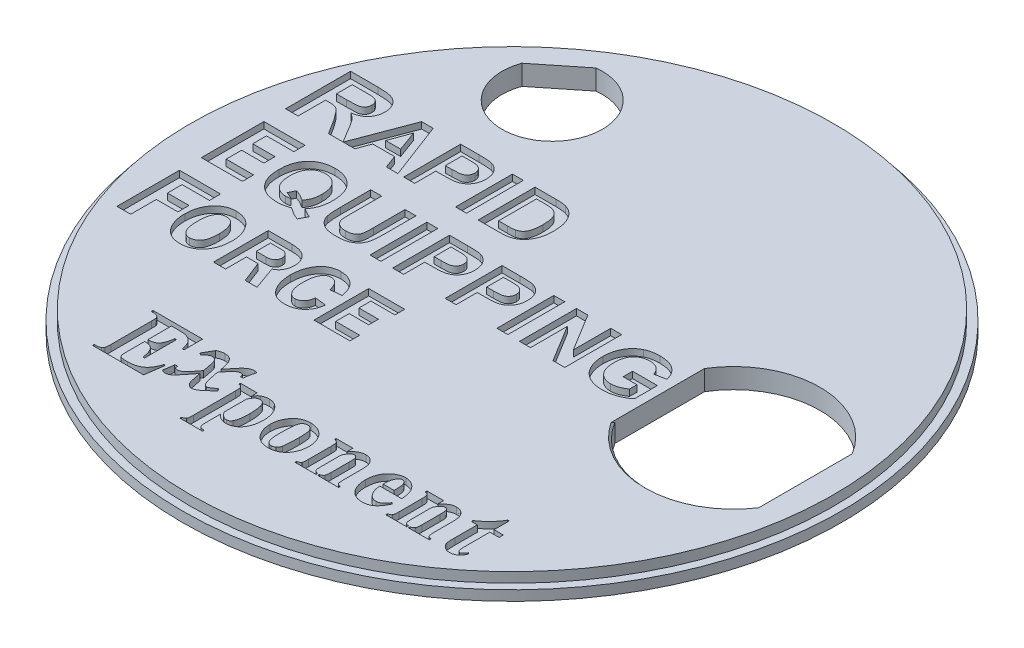
from build123d import *

# Parameters (mm, degrees)
SKETCH1_R           = 20.828
BOSS_EXTRUDE1_DEPTH = 1.27
CUT_EXTRUDE2_START  = -0.635
SKETCH2_R           = 20.828
SKETCH2_R_2         = 20.32
CUT_EXTRUDE2_DEPTH  = 0.635
CUT_EXTRUDE3_DEPTH  = 30.482606194
CHAMFER1_SIZE       = 0.127
CUT_EXTRUDE4_DEPTH  = 0.508
CUT_EXTRUDE5_DEPTH  = 30.482606194
SKETCH16_W          = 0.691470416
SKETCH16_H          = 3.595646159
SKETCH16_W_2        = 0.691470415
CUT_EXTRUDE7_DEPTH  = 0.4064


with BuildPart() as part:
    # Sketch1 → Boss-Extrude1 (new body)
    with BuildSketch(Plane(origin=(0, 0, 0), x_dir=(1, 0, 0), z_dir=(0, 1, 0))):
        with Locations(Location((0, 0, 0), (0, 0, 270))):
            Circle(SKETCH1_R)
    extrude(amount=BOSS_EXTRUDE1_DEPTH)

    # Sketch2 → Cut-Extrude2 (cut)
    with BuildSketch(Plane(origin=(0, 1.27, 0), x_dir=(1, 0, 0), z_dir=(0, 1, 0)).offset(CUT_EXTRUDE2_START)):
        with Locations(Location((0, 0, 0), (0, 0, 270))):
            Circle(SKETCH2_R)
        with Locations(Location((0, 0, 0), (0, 0, 270))):
            Circle(SKETCH2_R_2, mode=Mode.SUBTRACT)
    extrude(amount=CUT_EXTRUDE2_DEPTH, mode=Mode.SUBTRACT)

    # Sketch3 → Cut-Extrude3 (cut, through all)
    with BuildSketch(Plane(origin=(0, 1.27, 0), x_dir=(1, 0, 0), z_dir=(0, 1, 0))):
        with BuildLine():
            Line((18.66773, 2.835365662), (18.66773, -2.835365662))
            ThreePointArc((18.66773, -2.835365662), (14.00048, -5.461), (9.33323, -2.835365662))
            Line((9.33323, -2.835365662), (9.33323, 2.835365662))
            ThreePointArc((9.33323, 2.835365662), (14.00048, 5.461), (18.66773, 2.835365662))
        make_face()
    extrude(amount=-CUT_EXTRUDE3_DEPTH, mode=Mode.SUBTRACT)

    # Chamfer1
    chamfer1_edges = [part.edges().sort_by_distance(p)[0] for p in [
        (14.00048, 1.27, 5.461),
    ]]
    chamfer(chamfer1_edges, length=CHAMFER1_SIZE)

    # Sketch12 → Cut-Extrude4 (cut)
    with BuildSketch(Plane.XZ):
        with BuildLine():
            Line((-7.6581, 18.2626), (5.6769, 18.2626))
            ThreePointArc((5.6769, 18.2626), (6.799432015, 17.797632015), (7.2644, 16.6751))
            Line((7.2644, 16.6751), (7.2644, 3.3401))
            ThreePointArc((7.2644, 3.3401), (6.799432015, 2.217567985), (5.6769, 1.7526))
            Line((5.6769, 1.7526), (-7.6581, 1.7526))
            ThreePointArc((-7.6581, 1.7526), (-8.780632015, 2.217567985), (-9.2456, 3.3401))
            Line((-9.2456, 3.3401), (-9.2456, 16.6751))
            ThreePointArc((-9.2456, 16.6751), (-8.780632015, 17.797632015), (-7.6581, 18.2626))
        make_face()
    extrude(amount=-CUT_EXTRUDE4_DEPTH, mode=Mode.SUBTRACT)

    # Sketch13 → Cut-Extrude5 (cut, through all)
    with BuildSketch(Plane.XZ):
        with BuildLine():
            Line((-13.147857976, -13.773931894), (-10.55186717, -15.850724539))
            ThreePointArc((-10.55186717, -15.850724539), (-8.176593224, -10.22074153), (-13.147857976, -13.773931894))
        make_face()
    extrude(amount=-CUT_EXTRUDE5_DEPTH, mode=Mode.SUBTRACT)

    # Sketch16 → Cut-Extrude7 (cut)
    # profile 1 of 27: a face of its own
    with BuildSketch(Plane(origin=(0, 1.27, 0), x_dir=(1, 0, 0), z_dir=(0, 1, 0))):
        with BuildLine():
            Line((-18.120532318, 3.81), (-18.120532318, 7.919309896))
            Line((-18.120532318, 7.919309896), (-16.395972176, 7.919309896))
            add(Edge.make_bspline(
                [(-16.395972176, 7.919309896), (-16.343561088, 7.918986888), (-16.242555331, 7.918364391), (-16.0964813, 7.913825025), (-15.961768254, 7.904314787), (-15.837818605, 7.893544366), (-15.725227691, 7.877874096), (-15.62355035, 7.859101267), (-15.532957761, 7.837346147), (-15.452128126, 7.811290862), (-15.378427918, 7.781469684), (-15.309772559, 7.745974091), (-15.245407162, 7.704386642), (-15.184343138, 7.658140741), (-15.126321905, 7.60716533), (-15.072934099, 7.550111348), (-15.02324956, 7.487828346), (-14.977308378, 7.420834523), (-14.936837073, 7.349425697), (-14.899856926, 7.275895178), (-14.869753691, 7.199460492), (-14.844888693, 7.120481703), (-14.825026149, 7.039130284), (-14.811239865, 6.95519941), (-14.802633237, 6.868840999), (-14.801864922, 6.810508396), (-14.801474326, 6.780853248)],
                knots=[0, 0, 0, 0, 1.675828044, 3.229627355, 4.67171229, 5.993455049, 7.206927059, 8.304770529, 9.29850117, 10.183580433, 11.017754134, 11.837875825, 12.650738409, 13.464925643, 14.285328857, 15.117007378, 15.959673368, 16.830859064, 17.711229498, 18.58228265, 19.460420693, 20.334473227, 21.228207035, 22.135446768, 23.052097822, 24, 24, 24, 24], degree=3))
            add(Edge.make_bspline(
                [(-14.801474326, 6.780853248), (-14.802198823, 6.743496062), (-14.80361469, 6.670489824), (-14.81664425, 6.563485399), (-14.835996475, 6.46125031), (-14.863582922, 6.363642918), (-14.901513724, 6.271811225), (-14.94554675, 6.184468801), (-14.998063531, 6.101911913), (-15.058707271, 6.024958986), (-15.12742368, 5.953541901), (-15.2045139, 5.889130366), (-15.28942753, 5.831472647), (-15.382678246, 5.780901233), (-15.483616739, 5.737668154), (-15.59268071, 5.701293158), (-15.709376427, 5.671687964), (-15.790549904, 5.657757835), (-15.832094516, 5.650628391)],
                knots=[0, 0, 0, 0, 1.05911256, 2.069797862, 3.05271628, 4.008392045, 4.940519534, 5.866323021, 6.779546087, 7.71056835, 8.640711998, 9.585328432, 10.554502533, 11.547017206, 12.589327225, 13.664782803, 14.804835066, 16, 16, 16, 16], degree=3))
            add(Edge.make_bspline(
                [(-15.832094516, 5.650628391), (-15.79191621, 5.624017921), (-15.713281792, 5.571937607), (-15.604485415, 5.486160676), (-15.506812082, 5.396131153), (-15.432858761, 5.316071301), (-15.376033256, 5.245667261), (-15.330279015, 5.184091209), (-15.280925731, 5.113226105), (-15.228457453, 5.033033552), (-15.171323084, 4.944223065), (-15.111647556, 4.845435263), (-15.048182072, 4.737633736), (-15.005511593, 4.662328911), (-14.983396899, 4.623300917)],
                knots=[0, 0, 0, 0, 1.285445069, 2.515791127, 3.691898215, 4.826622834, 5.420063933, 6.105349801, 6.873086501, 7.723915395, 8.66222816, 9.690593598, 10.803111229, 12, 12, 12, 12], degree=3))
            Line((-14.983396899, 4.623300917), (-14.485373564, 3.81))
            Line((-14.485373564, 3.81), (-15.408980476, 3.81))
            Line((-15.408980476, 3.81), (-15.993437613, 4.742661881))
            add(Edge.make_bspline(
                [(-15.993437613, 4.742661881), (-16.020279369, 4.780014317), (-16.071525799, 4.851327795), (-16.145503188, 4.952666561), (-16.213185933, 5.042876265), (-16.27277277, 5.123263541), (-16.32727877, 5.191549221), (-16.375048911, 5.248923288), (-16.415110179, 5.296616905), (-16.460439604, 5.343907185), (-16.513175577, 5.392508421), (-16.578458499, 5.439630086), (-16.645498003, 5.477194979), (-16.717325477, 5.505857876), (-16.80039178, 5.525843552), (-16.900250631, 5.538576968), (-17.020041826, 5.547971539), (-17.10662686, 5.548350126), (-17.153296916, 5.548554187)],
                knots=[0, 0, 0, 0, 1.465447777, 2.797841088, 3.997266218, 5.05856206, 5.985598736, 6.780315439, 7.437430484, 7.969193402, 8.866571936, 9.718200644, 10.52825214, 11.309096006, 12.174169268, 13.242355782, 14.513606761, 16, 16, 16, 16], degree=3))
            Line((-17.153296916, 5.548554187), (-17.330280415, 5.548554187))
            Line((-17.330280415, 5.548554187), (-17.330280415, 3.81))
            Line((-17.330280415, 3.81), (-18.120532318, 3.81))
        make_face()
        with BuildLine():
            Line((-17.330280415, 6.233439169), (-16.693962998, 6.233439169))
            add(Edge.make_bspline(
                [(-16.693962998, 6.233439169), (-16.644844275, 6.233544434), (-16.551264809, 6.23374498), (-16.418192946, 6.236649815), (-16.299314965, 6.239115317), (-16.195342259, 6.245309994), (-16.105809647, 6.251449504), (-16.03107629, 6.259428638), (-15.970512538, 6.268859718), (-15.910019529, 6.28352257), (-15.848054133, 6.309069696), (-15.782010746, 6.345456323), (-15.725565097, 6.392659646), (-15.676670129, 6.447231461), (-15.639370117, 6.511385592), (-15.610155386, 6.582263902), (-15.595342898, 6.661441367), (-15.592957045, 6.716321662), (-15.591726229, 6.744633369)],
                knots=[0, 0, 0, 0, 1.697953026, 3.23488743, 4.60134403, 5.807846676, 6.835100678, 7.703488618, 8.405232423, 8.952775585, 9.851109663, 10.713519226, 11.549115941, 12.382556273, 13.233359028, 14.101746968, 15.020727134, 16, 16, 16, 16], degree=3))
            add(Edge.make_bspline(
                [(-15.591726229, 6.744633369), (-15.593126051, 6.776305867), (-15.595826783, 6.837412844), (-15.617125137, 6.924368655), (-15.654300548, 7.001182141), (-15.705356496, 7.067980125), (-15.769449196, 7.124385306), (-15.84579069, 7.169158742), (-15.933813813, 7.20250414), (-15.997301774, 7.21481853), (-16.030480671, 7.221254048)],
                knots=[0, 0, 0, 0, 1.062977961, 2.050844577, 2.982300261, 3.90936959, 4.856017476, 5.831122378, 6.86654153, 8, 8, 8, 8], degree=3))
            add(Edge.make_bspline(
                [(-16.030480671, 7.221254048), (-16.041447989, 7.222459121), (-16.067442835, 7.225315396), (-16.113346652, 7.227149856), (-16.172040571, 7.22996962), (-16.244235023, 7.231121995), (-16.329285028, 7.233142007), (-16.427528781, 7.233512932), (-16.538654155, 7.234698012), (-16.617132476, 7.234519278), (-16.658566298, 7.234424913)],
                knots=[0, 0, 0, 0, 0.42127143, 0.998501726, 1.753681744, 2.66564073, 3.755712164, 5.002818897, 6.417592707, 8, 8, 8, 8], degree=3))
            Line((-16.658566298, 7.234424913), (-17.330280415, 7.234424913))
            Line((-17.330280415, 7.234424913), (-17.330280415, 6.233439169))
        make_face(mode=Mode.SUBTRACT)
    # profile 2 of 27: a face of its own
    with BuildSketch(Plane(origin=(0, 1.27, 0), x_dir=(1, 0, 0), z_dir=(0, 1, 0))):
        Polygon((-15.510164954, -1.524), (-18.108880708, -1.524), (-18.108880708, 2.428213542), (-15.510164954, 2.428213542), (-15.510164954, 1.724394692), (-17.242642123, 1.724394692), (-17.242642123, 0.858156107), (-15.835004424, 0.858156107), (-15.835004424, 0.154337257), (-17.242642123, 0.154337257), (-17.242642123, -0.82018115), (-15.510164954, -0.82018115), align=None)
    # profile 3 of 27: a face of its own
    with BuildSketch(Plane(origin=(0, 1.27, 0), x_dir=(1, 0, 0), z_dir=(0, 1, 0))):
        Polygon((-17.242642123, -6.858), (-18.108880708, -6.858), (-18.108880708, -2.905786458), (-15.510164954, -2.905786458), (-15.510164954, -3.609605308), (-17.242642123, -3.609605308), (-17.242642123, -4.532521613), (-15.878993102, -4.532521613), (-15.878993102, -5.236340462), (-17.242642123, -5.236340462), align=None)
    # profile 4 of 27: a face of its own
    with BuildSketch(Plane(origin=(0, 1.27, 0), x_dir=(1, 0, 0), z_dir=(0, 1, 0))):
        Polygon((-11.020647924, 3.81), (-11.753894677, 3.81), (-12.057133265, 4.639764498), (-13.437192969, 4.639764498), (-13.740431557, 3.81), (-14.478, 3.81), (-13.118828465, 7.405646159), (-12.386301994, 7.405646159), align=None)
        Polygon((-12.276819178, 5.239038858), (-12.749323962, 6.529783633), (-13.220388182, 5.239038858), align=None, mode=Mode.SUBTRACT)
    # profile 5 of 27: a face of its own
    with BuildSketch(Plane(origin=(0, 1.27, 0), x_dir=(1, 0, 0), z_dir=(0, 1, 0))):
        with BuildLine():
            Line((-10.651863703, 3.81), (-10.651863703, 7.405646159))
            Line((-10.651863703, 7.405646159), (-9.501573856, 7.405646159))
            add(Edge.make_bspline(
                [(-9.501573856, 7.405646159), (-9.449471778, 7.405589261), (-9.34982036, 7.405480437), (-9.207673639, 7.402456849), (-9.079691813, 7.398176626), (-8.966064828, 7.39284579), (-8.866392859, 7.384891159), (-8.781123023, 7.375679816), (-8.709718383, 7.365770856), (-8.667670306, 7.355516407), (-8.648760344, 7.350904751)],
                knots=[0, 0, 0, 0, 1.460485487, 2.793352117, 3.985295279, 5.050041172, 5.981765236, 6.787433016, 7.454681457, 8, 8, 8, 8], degree=3))
            add(Edge.make_bspline(
                [(-8.648760344, 7.350904751), (-8.623614692, 7.343734757), (-8.573706465, 7.329503998), (-8.502203539, 7.29916628), (-8.43328604, 7.264006485), (-8.367819844, 7.222102363), (-8.30558241, 7.174197862), (-8.24638874, 7.12068365), (-8.189923163, 7.061318151), (-8.136966807, 6.996218638), (-8.088465015, 6.925713378), (-8.046547281, 6.84969813), (-8.011428984, 6.768503295), (-7.981508778, 6.682739042), (-7.959433508, 6.59148584), (-7.943984832, 6.495377725), (-7.933230626, 6.394372663), (-7.932469195, 6.325253036), (-7.93208007, 6.289929833)],
                knots=[0, 0, 0, 0, 0.907145743, 1.80047177, 2.69161667, 3.591261238, 4.495029544, 5.415863088, 6.359363025, 7.337192411, 8.326890979, 9.326929023, 10.346104993, 11.395420813, 12.477187422, 13.601053412, 14.774031606, 16, 16, 16, 16], degree=3))
            add(Edge.make_bspline(
                [(-7.93208007, 6.289929833), (-7.933189853, 6.236287533), (-7.935326246, 6.13302316), (-7.959228692, 5.984981165), (-7.995685803, 5.849754346), (-8.048970505, 5.728645219), (-8.113935625, 5.621178529), (-8.185496043, 5.524297817), (-8.267207524, 5.440923164), (-8.355489571, 5.369709056), (-8.44878756, 5.311430384), (-8.542254438, 5.261748644), (-8.637151402, 5.223551735), (-8.701851941, 5.206909035), (-8.733753582, 5.198703084)],
                knots=[0, 0, 0, 0, 1.312386234, 2.526415563, 3.661883817, 4.733421185, 5.753802465, 6.732107337, 7.675884281, 8.604170108, 9.50284679, 10.365392406, 11.194030444, 12, 12, 12, 12], degree=3))
            add(Edge.make_bspline(
                [(-8.733753582, 5.198703084), (-8.756523409, 5.194371728), (-8.804519487, 5.185241746), (-8.880638396, 5.176140815), (-8.963840489, 5.166067078), (-9.054467981, 5.15949642), (-9.152411238, 5.153343274), (-9.257632227, 5.150438171), (-9.369980576, 5.146938112), (-9.447309168, 5.14687522), (-9.487168222, 5.146842803)],
                knots=[0, 0, 0, 0, 0.735353946, 1.55003838, 2.431865514, 3.394945452, 4.432993119, 5.54609699, 6.735134699, 8, 8, 8, 8], degree=3))
            Line((-9.487168222, 5.146842803), (-9.960393288, 5.146842803))
            Line((-9.960393288, 5.146842803), (-9.960393288, 3.81))
            Line((-9.960393288, 3.81), (-10.651863703, 3.81))
        make_face()
        with BuildLine():
            Line((-9.960393288, 6.806371799), (-9.960393288, 5.746117162))
            Line((-9.960393288, 5.746117162), (-9.545511038, 5.746117162))
            add(Edge.make_bspline(
                [(-9.545511038, 5.746117162), (-9.509733906, 5.746163491), (-9.44128775, 5.746252123), (-9.3430827, 5.749433492), (-9.254187396, 5.753316942), (-9.174416093, 5.759744847), (-9.104250314, 5.768216673), (-9.043220174, 5.778350043), (-8.991254544, 5.789224208), (-8.93506079, 5.807244442), (-8.874978432, 5.836399537), (-8.810817535, 5.878302731), (-8.754452263, 5.928402942), (-8.707548885, 5.987243906), (-8.670083471, 6.052619625), (-8.643258207, 6.123860108), (-8.625937159, 6.199784651), (-8.62435504, 6.252379551), (-8.623550485, 6.279125607)],
                knots=[0, 0, 0, 0, 1.411705958, 2.700771114, 3.876961699, 4.922619712, 5.858038221, 6.66485904, 7.363650596, 7.950905807, 8.989198271, 9.987739806, 10.967313358, 11.951275539, 12.944273208, 13.927870418, 14.946261014, 16, 16, 16, 16], degree=3))
            add(Edge.make_bspline(
                [(-8.623550485, 6.279125607), (-8.624682807, 6.311701887), (-8.626878231, 6.374862998), (-8.651087625, 6.464814962), (-8.688439954, 6.546447459), (-8.74184318, 6.617220535), (-8.80635302, 6.676734872), (-8.878859388, 6.726252916), (-8.96091069, 6.76090602), (-9.018981019, 6.774332818), (-9.048516678, 6.78116194)],
                knots=[0, 0, 0, 0, 1.085904563, 2.105425768, 3.088705091, 4.068969419, 5.045188284, 6.010769642, 6.988240112, 8, 8, 8, 8], degree=3))
            add(Edge.make_bspline(
                [(-9.048516678, 6.78116194), (-9.061226546, 6.78319478), (-9.089438515, 6.787707054), (-9.136332547, 6.792416174), (-9.191808195, 6.796699113), (-9.255932329, 6.800215534), (-9.328450777, 6.802964561), (-9.409602737, 6.805373387), (-9.49917448, 6.805566904), (-9.56183801, 6.806096067), (-9.594490193, 6.806371799)],
                knots=[0, 0, 0, 0, 0.564603001, 1.253243608, 2.066786758, 3.005752288, 4.070476343, 5.250658742, 6.567396469, 8, 8, 8, 8], degree=3))
            Line((-9.594490193, 6.806371799), (-9.960393288, 6.806371799))
        make_face(mode=Mode.SUBTRACT)
    # profile 6 of 27: a face of its own
    with BuildSketch(Plane(origin=(0, 1.27, 0), x_dir=(1, 0, 0), z_dir=(0, 1, 0))):
        with Locations((-7.03316853, 5.60782308)):
            Rectangle(SKETCH16_W, SKETCH16_H)
    # profile 7 of 27: a face of its own
    with BuildSketch(Plane(origin=(0, 1.27, 0), x_dir=(1, 0, 0), z_dir=(0, 1, 0))):
        with BuildLine():
            Line((-5.94986488, 7.405646159), (-4.631029119, 7.405646159))
            add(Edge.make_bspline(
                [(-4.631029119, 7.405646159), (-4.595009573, 7.405664832), (-4.524871151, 7.405701192), (-4.423081937, 7.401478418), (-4.327895936, 7.397230863), (-4.239586354, 7.388728187), (-4.15784682, 7.379815874), (-4.082530653, 7.368532215), (-4.014113631, 7.354070972), (-3.970969896, 7.342666552), (-3.950362929, 7.337219399)],
                knots=[0, 0, 0, 0, 1.259756885, 2.453039283, 3.563158368, 4.591894114, 5.55549294, 6.43918076, 7.254497783, 8, 8, 8, 8], degree=3))
            add(Edge.make_bspline(
                [(-3.950362929, 7.337219399), (-3.924592658, 7.328820466), (-3.873516299, 7.312173883), (-3.798636786, 7.283006299), (-3.727692346, 7.246832613), (-3.658051025, 7.208807339), (-3.59282181, 7.163846876), (-3.528552644, 7.117071532), (-3.469414492, 7.062887189), (-3.39186241, 6.987161003), (-3.303369591, 6.88167203), (-3.210659878, 6.741746208), (-3.132190332, 6.588158368), (-3.078576331, 6.45054901), (-3.042374076, 6.333569433), (-3.018709057, 6.239781473), (-2.998607063, 6.14098782), (-2.982103263, 6.037163566), (-2.969280286, 5.928308699), (-2.959733443, 5.814452232), (-2.955083167, 5.695495808), (-2.954030269, 5.614548699), (-2.953493081, 5.573249559)],
                knots=[0, 0, 0, 0, 0.745524535, 1.477620414, 2.207090574, 2.934465325, 3.657932502, 4.384347339, 5.118673636, 5.861150177, 7.365375624, 8.894729774, 10.468936425, 12.099947606, 12.950091786, 13.83580991, 14.759228729, 15.722225242, 16.726454549, 17.773376212, 18.863978586, 20, 20, 20, 20], degree=3))
            add(Edge.make_bspline(
                [(-2.953493081, 5.573249559), (-2.954473695, 5.501871968), (-2.956370185, 5.363829139), (-2.978341135, 5.164633915), (-3.010004049, 4.979617697), (-3.045694721, 4.864196537), (-3.062975896, 4.808310412)],
                knots=[0, 0, 0, 0, 1.103207939, 2.133582005, 3.096293362, 4, 4, 4, 4], degree=3))
            add(Edge.make_bspline(
                [(-3.062975896, 4.808310412), (-3.074387198, 4.776241735), (-3.096835009, 4.713157645), (-3.136116995, 4.622158536), (-3.178561459, 4.535559424), (-3.224520459, 4.45342854), (-3.274226195, 4.376135309), (-3.327864583, 4.303910922), (-3.384604187, 4.235804521), (-3.425708747, 4.193884709), (-3.446165751, 4.173021968)],
                knots=[0, 0, 0, 0, 1.090884612, 2.145940218, 3.175104604, 4.181306866, 5.161203701, 6.118658341, 7.063689906, 8, 8, 8, 8], degree=3))
            add(Edge.make_bspline(
                [(-3.446165751, 4.173021968), (-3.479270127, 4.143250943), (-3.547536068, 4.081858845), (-3.667832348, 4.005883671), (-3.803800971, 3.938749919), (-3.902152359, 3.904264424), (-3.953244056, 3.886349858)],
                knots=[0, 0, 0, 0, 0.908140292, 1.872714733, 2.8949153, 4, 4, 4, 4], degree=3))
            add(Edge.make_bspline(
                [(-3.953244056, 3.886349858), (-3.973811057, 3.88003312), (-4.016496803, 3.866923056), (-4.084179263, 3.852921236), (-4.156431987, 3.838170181), (-4.234088149, 3.829283918), (-4.316341641, 3.81991296), (-4.403847947, 3.814651691), (-4.496303728, 3.810916496), (-4.559716882, 3.810310028), (-4.592133908, 3.81)],
                knots=[0, 0, 0, 0, 0.799129865, 1.658552685, 2.566799617, 3.538529252, 4.561352959, 5.643373779, 6.795284424, 8, 8, 8, 8], degree=3))
            Line((-4.592133908, 3.81), (-5.94986488, 3.81))
            Line((-5.94986488, 3.81), (-5.94986488, 7.405646159))
        make_face()
        with BuildLine():
            Line((-5.258394464, 6.806371799), (-5.258394464, 4.40927436))
            Line((-5.258394464, 4.40927436), (-4.689371935, 4.40927436))
            add(Edge.make_bspline(
                [(-4.689371935, 4.40927436), (-4.66368206, 4.409478098), (-4.614219236, 4.409870372), (-4.542645263, 4.411023022), (-4.476869383, 4.414143463), (-4.416547023, 4.417375731), (-4.361835226, 4.422716003), (-4.31249593, 4.427968365), (-4.268803784, 4.435316309), (-4.241818441, 4.441116679), (-4.22911194, 4.443847881)],
                knots=[0, 0, 0, 0, 1.333384787, 2.567275092, 3.714769766, 4.750907381, 5.701951617, 6.567520054, 7.325492842, 8, 8, 8, 8], degree=3))
            add(Edge.make_bspline(
                [(-4.22911194, 4.443847881), (-4.199351876, 4.451789342), (-4.141387119, 4.467257215), (-4.059998742, 4.501739554), (-3.986352745, 4.543338724), (-3.919215786, 4.593359938), (-3.858711488, 4.656575183), (-3.807063673, 4.737422523), (-3.759264982, 4.833844383), (-3.726532427, 4.926144217), (-3.703037062, 5.008584269), (-3.687132627, 5.07777824), (-3.674563783, 5.15263912), (-3.663752937, 5.232871459), (-3.655017517, 5.318372083), (-3.649581925, 5.40944975), (-3.6458721, 5.50599297), (-3.645272101, 5.572285412), (-3.644963496, 5.606382516)],
                knots=[0, 0, 0, 0, 1.038686998, 2.023088296, 2.974059649, 3.888265163, 4.839857954, 5.909819677, 7.113156087, 8.466843969, 9.20827164, 10.006482943, 10.861893492, 11.769681931, 12.739021491, 13.762258324, 14.849031541, 16, 16, 16, 16], degree=3))
            add(Edge.make_bspline(
                [(-3.644963496, 5.606382516), (-3.645269728, 5.640479725), (-3.645862957, 5.706532441), (-3.649567092, 5.80235579), (-3.654972152, 5.891999237), (-3.663769783, 5.975573595), (-3.674413043, 6.05319437), (-3.687129111, 6.124927247), (-3.702937671, 6.190301466), (-3.726453021, 6.267967245), (-3.762101079, 6.355265993), (-3.81061113, 6.450713723), (-3.870183142, 6.532066511), (-3.936004415, 6.602739008), (-4.011897455, 6.660898901), (-4.095910866, 6.7096112), (-4.189873861, 6.747419772), (-4.256712691, 6.763523683), (-4.291056165, 6.771798278)],
                knots=[0, 0, 0, 0, 1.117996097, 2.165769068, 3.143980016, 4.062055362, 4.920439205, 5.712587309, 6.449616741, 7.124491204, 8.371470382, 9.537068822, 10.625202851, 11.666538334, 12.693249444, 13.747832046, 14.842779399, 16, 16, 16, 16], degree=3))
            add(Edge.make_bspline(
                [(-4.291056165, 6.771798278), (-4.305921694, 6.774560502), (-4.338649898, 6.78064186), (-4.392959202, 6.787744922), (-4.456676118, 6.793016001), (-4.530125462, 6.79839731), (-4.61300983, 6.801468791), (-4.70567603, 6.804674381), (-4.807736299, 6.805769405), (-4.879046367, 6.806165231), (-4.916260665, 6.806371799)],
                knots=[0, 0, 0, 0, 0.578738571, 1.274160813, 2.095454135, 3.025967819, 4.093109015, 5.270126069, 6.575371698, 8, 8, 8, 8], degree=3))
            Line((-4.916260665, 6.806371799), (-5.258394464, 6.806371799))
        make_face(mode=Mode.SUBTRACT)
    # profile 8 of 27: a face of its own
    with BuildSketch(Plane(origin=(0, 1.27, 0), x_dir=(1, 0, 0), z_dir=(0, 1, 0))):
        with BuildLine():
            add(Edge.make_bspline(
                [(-12.034026231, -1.039250428), (-11.989568281, -1.069723387), (-11.900479635, -1.130787712), (-11.75877604, -1.209782143), (-11.612567844, -1.281595972), (-11.510956801, -1.320222547), (-11.45996173, -1.339607889)],
                knots=[0, 0, 0, 0, 0.994855506, 1.99357661, 2.993045438, 4, 4, 4, 4], degree=3))
            Line((-11.45996173, -1.339607889), (-11.724305108, -1.846686194))
            add(Edge.make_bspline(
                [(-11.724305108, -1.846686194), (-11.778346951, -1.829957478), (-11.887289781, -1.796234098), (-11.990125819, -1.746925959), (-12.04194933, -1.722077463)],
                knots=[0, 0, 0, 0, 0.992113803, 2, 2, 2, 2], degree=3))
            add(Edge.make_bspline(
                [(-12.04194933, -1.722077463), (-12.047034735, -1.719511671), (-12.061761386, -1.712081483), (-12.088510311, -1.693790127), (-12.129322669, -1.669136503), (-12.182449286, -1.634988101), (-12.248424784, -1.592661044), (-12.327462622, -1.542200997), (-12.418472793, -1.482181226), (-12.483923851, -1.439908214), (-12.518775804, -1.417398311)],
                knots=[0, 0, 0, 0, 0.241377655, 0.698997227, 1.371388316, 2.263975901, 3.376788369, 4.695767198, 6.240533187, 8, 8, 8, 8], degree=3))
            add(Edge.make_bspline(
                [(-12.518775804, -1.417398311), (-12.547680075, -1.429776705), (-12.605768032, -1.454653152), (-12.695894004, -1.485285081), (-12.788311827, -1.511089437), (-12.882693164, -1.532973206), (-12.979437484, -1.549233495), (-13.078408024, -1.56170326), (-13.179882223, -1.56901621), (-13.248409578, -1.569735174), (-13.282994669, -1.570098028)],
                knots=[0, 0, 0, 0, 0.961025642, 1.931341354, 2.907359807, 3.893838693, 4.891829695, 5.905170566, 6.942759923, 8, 8, 8, 8], degree=3))
            add(Edge.make_bspline(
                [(-13.282994669, -1.570098028), (-13.348598044, -1.56850132), (-13.476833928, -1.565380213), (-13.663818246, -1.543260083), (-13.839512668, -1.504919766), (-14.004688365, -1.452549912), (-14.158352437, -1.383801154), (-14.301852876, -1.300699626), (-14.433202912, -1.201089253), (-14.554212303, -1.08802292), (-14.661270805, -0.960227815), (-14.754993016, -0.819934694), (-14.83438846, -0.667608616), (-14.898408096, -0.502447414), (-14.949004246, -0.325786575), (-14.983500293, -0.136378986), (-15.00570227, 0.06465203), (-15.008219445, 0.202933701), (-15.009509862, 0.273823079)],
                knots=[0, 0, 0, 0, 1.098101164, 2.146474535, 3.146072545, 4.104420533, 5.041773038, 5.958565538, 6.874115049, 7.795336865, 8.725215067, 9.658214839, 10.614563411, 11.594512188, 12.618591104, 13.685899083, 14.813688224, 16, 16, 16, 16], degree=3))
            add(Edge.make_bspline(
                [(-15.009509862, 0.273823079), (-15.008216518, 0.344709565), (-15.005702345, 0.482508056), (-14.983651989, 0.683151764), (-14.948005606, 0.871882639), (-14.897925362, 1.048824191), (-14.832946866, 1.213511548), (-14.753241039, 1.365852473), (-14.659371481, 1.506441605), (-14.551043873, 1.633954937), (-14.430676032, 1.748178324), (-14.298944391, 1.847048335), (-14.157380556, 1.931464151), (-14.005421654, 2.000147981), (-13.842648196, 2.052488977), (-13.670299582, 2.090707234), (-13.487421687, 2.113097834), (-13.362287648, 2.116169221), (-13.298120584, 2.117744187)],
                knots=[0, 0, 0, 0, 1.193283781, 2.319662245, 3.393996131, 4.424093603, 5.411284417, 6.369670503, 7.313761776, 8.251713527, 9.181123148, 10.102053383, 11.01932051, 11.951118596, 12.903560284, 13.893239571, 14.919681386, 16, 16, 16, 16], degree=3))
            add(Edge.make_bspline(
                [(-13.298120584, 2.117744187), (-13.234414399, 2.116586151), (-13.110160793, 2.1143275), (-12.92898156, 2.090170704), (-12.757783303, 2.053518887), (-12.596362379, 2.000685257), (-12.445545847, 1.932071012), (-12.304548818, 1.848764749), (-12.174193596, 1.750062752), (-12.054443286, 1.636929322), (-11.947338775, 1.50985595), (-11.852459129, 1.370932604), (-11.774560933, 1.218446666), (-11.708936521, 1.054985263), (-11.660016942, 0.878954169), (-11.623904349, 0.691362549), (-11.602159589, 0.491619336), (-11.599578962, 0.354309206), (-11.598255813, 0.283907023)],
                knots=[0, 0, 0, 0, 1.078752742, 2.104017338, 3.091035458, 4.041673215, 4.975566109, 5.892967701, 6.810684895, 7.740128604, 8.678185021, 9.621404646, 10.583875016, 11.573429805, 12.6009998, 13.674031063, 14.80742018, 16, 16, 16, 16], degree=3))
            add(Edge.make_bspline(
                [(-11.598255813, 0.283907023), (-11.599683106, 0.209646822), (-11.602457721, 0.065287205), (-11.626605067, -0.144355538), (-11.665748724, -0.340690551), (-11.70607574, -0.464069588), (-11.725745671, -0.524249025)],
                knots=[0, 0, 0, 0, 1.083667057, 2.106616435, 3.076482036, 4, 4, 4, 4], degree=3))
            add(Edge.make_bspline(
                [(-11.725745671, -0.524249025), (-11.743378062, -0.568576123), (-11.779247971, -0.658751582), (-11.850149639, -0.788914314), (-11.934508309, -0.917330055), (-12.000383338, -0.998034192), (-12.034026231, -1.039250428)],
                knots=[0, 0, 0, 0, 0.948216854, 1.928975575, 2.942311585, 4, 4, 4, 4], degree=3))
        make_face()
        with BuildLine():
            add(Edge.make_bspline(
                [(-12.610971859, -0.669025643), (-12.584974234, -0.640603475), (-12.532916765, -0.583691115), (-12.468542697, -0.486210412), (-12.412339474, -0.381673648), (-12.36815133, -0.267472759), (-12.332612626, -0.145346775), (-12.307809611, -0.014387708), (-12.292405091, 0.125075233), (-12.290635406, 0.220960517), (-12.289726229, 0.270221671)],
                knots=[0, 0, 0, 0, 0.906820982, 1.815812261, 2.745108282, 3.70056618, 4.696560745, 5.740060838, 6.83895416, 8, 8, 8, 8], degree=3))
            add(Edge.make_bspline(
                [(-12.289726229, 0.270221671), (-12.29052362, 0.320906511), (-12.292068293, 0.41909114), (-12.304862608, 0.561669326), (-12.327377447, 0.694200493), (-12.356761992, 0.817237461), (-12.396797925, 0.929784407), (-12.445081043, 1.032689656), (-12.501687306, 1.126206403), (-12.568007752, 1.20879173), (-12.640954024, 1.281395981), (-12.718932594, 1.345534156), (-12.803082618, 1.399221773), (-12.892975507, 1.442410133), (-12.987859007, 1.476392929), (-13.087957923, 1.501063663), (-13.193498043, 1.515500819), (-13.26566355, 1.517467513), (-13.302442274, 1.518469827)],
                knots=[0, 0, 0, 0, 1.335693338, 2.587451293, 3.768164612, 4.876224393, 5.916940853, 6.910477009, 7.867661778, 8.790666633, 9.694493319, 10.576027549, 11.446684429, 12.318352473, 13.199023277, 14.098364444, 15.030842682, 16, 16, 16, 16], degree=3))
            add(Edge.make_bspline(
                [(-13.302442274, 1.518469827), (-13.339467232, 1.517500039), (-13.411885042, 1.515603212), (-13.517529026, 1.500815974), (-13.617856369, 1.477333597), (-13.71262145, 1.443082351), (-13.802680988, 1.399812061), (-13.887145435, 1.346223889), (-13.966003021, 1.283092825), (-14.039316662, 1.210946994), (-14.104796413, 1.128335527), (-14.16300274, 1.036447154), (-14.211121228, 0.934224261), (-14.249762053, 0.822240411), (-14.280642337, 0.70107109), (-14.302879793, 0.570066056), (-14.315690814, 0.429422101), (-14.317240889, 0.332432776), (-14.318039446, 0.28246646)],
                knots=[0, 0, 0, 0, 0.980107447, 1.917010591, 2.819119613, 3.703969481, 4.579773866, 5.459928929, 6.346604172, 7.250235365, 8.177620171, 9.131899985, 10.124404622, 11.161948974, 12.264485933, 13.431998172, 14.677033863, 16, 16, 16, 16], degree=3))
            add(Edge.make_bspline(
                [(-14.318039446, 0.28246646), (-14.317260543, 0.231777312), (-14.315748008, 0.133345194), (-14.302658057, -0.009372552), (-14.281436844, -0.142343147), (-14.251228065, -0.265511554), (-14.212604908, -0.379018482), (-14.165031575, -0.482705757), (-14.108760281, -0.576443716), (-14.043609897, -0.65938184), (-13.97193829, -0.732347286), (-13.895354127, -0.795957338), (-13.814479023, -0.850448323), (-13.728935711, -0.894722134), (-13.638701249, -0.928723168), (-13.544090302, -0.953262357), (-13.444552279, -0.96788897), (-13.376680322, -0.96983233), (-13.342057767, -0.970823668)],
                knots=[0, 0, 0, 0, 1.356840463, 2.634818045, 3.833173645, 4.958776583, 6.025986406, 7.038359119, 8.007356852, 8.946032033, 9.855123386, 10.740685277, 11.607120956, 12.460971081, 13.313368256, 14.183325659, 15.073285775, 16, 16, 16, 16], degree=3))
            add(Edge.make_bspline(
                [(-13.342057767, -0.970823668), (-13.316092821, -0.970368109), (-13.264947279, -0.969470752), (-13.189385436, -0.959383696), (-13.115780331, -0.944801598), (-13.068239539, -0.929953683), (-13.044581432, -0.922564795)],
                knots=[0, 0, 0, 0, 1.028828871, 2.026578908, 3.017950568, 4, 4, 4, 4], degree=3))
            add(Edge.make_bspline(
                [(-13.044581432, -0.922564795), (-13.080852517, -0.903612698), (-13.152678638, -0.866082647), (-13.263725314, -0.818262522), (-13.374993871, -0.77517769), (-13.450670101, -0.751900416), (-13.488274948, -0.740333529)],
                knots=[0, 0, 0, 0, 1.021704821, 2.023239566, 3.017713044, 4, 4, 4, 4], degree=3))
            Line((-13.488274948, -0.740333529), (-13.287316359, -0.32545128))
            add(Edge.make_bspline(
                [(-13.287316359, -0.32545128), (-13.228548424, -0.345759773), (-13.110445337, -0.386572771), (-12.939840175, -0.46761336), (-12.7716125, -0.559848809), (-12.664921424, -0.632359687), (-12.610971859, -0.669025643)],
                knots=[0, 0, 0, 0, 0.979271047, 1.967993817, 2.972492781, 4, 4, 4, 4], degree=3))
        make_face(mode=Mode.SUBTRACT)
    # profile 9 of 27: a face of its own
    with BuildSketch(Plane(origin=(0, 1.27, 0), x_dir=(1, 0, 0), z_dir=(0, 1, 0))):
        with BuildLine():
            Line((-10.998981454, 2.071646159), (-10.307511038, 2.071646159))
            Line((-10.307511038, 2.071646159), (-10.307511038, 0.120403081))
            add(Edge.make_bspline(
                [(-10.307511038, 0.120403081), (-10.307247061, 0.083428662), (-10.306743102, 0.012840987), (-10.306396199, -0.088007061), (-10.304476395, -0.17855301), (-10.300313113, -0.258942762), (-10.297455737, -0.329135318), (-10.2921499, -0.389143562), (-10.286856923, -0.438944123), (-10.281710877, -0.468565909), (-10.279420053, -0.481752405)],
                knots=[0, 0, 0, 0, 1.470600056, 2.807515117, 4.011048972, 5.072079398, 6.00911328, 6.804506435, 7.467811572, 8, 8, 8, 8], degree=3))
            add(Edge.make_bspline(
                [(-10.279420053, -0.481752405), (-10.269975552, -0.517301273), (-10.251378137, -0.587301481), (-10.200116822, -0.682989906), (-10.132401349, -0.767333228), (-10.063329071, -0.827483593), (-10.000847873, -0.870053558), (-9.947775216, -0.895962253), (-9.891465473, -0.919579694), (-9.830728227, -0.937701156), (-9.766215347, -0.953558088), (-9.697147584, -0.962726677), (-9.624107831, -0.969763341), (-9.574043731, -0.970463905), (-9.548334145, -0.970823668)],
                knots=[0, 0, 0, 0, 1.376921055, 2.711331395, 4.038631339, 5.418057255, 6.132954575, 6.870556231, 7.630397752, 8.422890386, 9.247036838, 10.121396817, 11.035274583, 12, 12, 12, 12], degree=3))
            add(Edge.make_bspline(
                [(-9.548334145, -0.970823668), (-9.522395984, -0.970353231), (-9.471894914, -0.969437299), (-9.398710242, -0.963982607), (-9.330430195, -0.953691485), (-9.267096541, -0.940197835), (-9.208374775, -0.923144124), (-9.154733369, -0.90155212), (-9.106256855, -0.875568101), (-9.049297683, -0.836403765), (-8.988009687, -0.78115563), (-8.929027817, -0.706038734), (-8.886814953, -0.623117853), (-8.867015331, -0.547404885), (-8.85683899, -0.481438502), (-8.850639016, -0.423715626), (-8.844968826, -0.358393358), (-8.83981986, -0.285650617), (-8.836298628, -0.205432799), (-8.834394055, -0.117537029), (-8.832895146, -0.021977325), (-8.832551957, 0.044292669), (-8.832374153, 0.078626743)],
                knots=[0, 0, 0, 0, 1.036876239, 2.018776863, 2.930845756, 3.794842666, 4.605604932, 5.371924355, 6.101864688, 6.799283669, 8.1310906, 9.382718023, 10.597336334, 11.822035891, 12.492591141, 13.265194674, 14.141890321, 15.11351293, 16.179860579, 17.351049011, 18.627594861, 20, 20, 20, 20], degree=3))
            Line((-8.832374153, 0.078626743), (-8.832374153, 2.071646159))
            Line((-8.832374153, 2.071646159), (-8.140903738, 2.071646159))
            Line((-8.140903738, 2.071646159), (-8.140903738, 0.190990686))
            add(Edge.make_bspline(
                [(-8.140903738, 0.190990686), (-8.140992365, 0.139129886), (-8.14116266, 0.039480783), (-8.143821575, -0.103889413), (-8.149472613, -0.235425557), (-8.154204869, -0.355353123), (-8.163333198, -0.463366162), (-8.172890527, -0.559531833), (-8.185202543, -0.643833329), (-8.202759592, -0.73965423), (-8.232265355, -0.847159116), (-8.2798185, -0.965912049), (-8.340592848, -1.073951799), (-8.414346227, -1.171692902), (-8.500653757, -1.259523833), (-8.600807711, -1.337099299), (-8.713778211, -1.405362399), (-8.817302626, -1.454516097), (-8.907562653, -1.487614587), (-8.981077936, -1.510014161), (-9.059756145, -1.52866832), (-9.143505005, -1.543472055), (-9.232360502, -1.555953793), (-9.326354897, -1.564289549), (-9.425345987, -1.569491649), (-9.492865562, -1.569892652), (-9.527445976, -1.570098028)],
                knots=[0, 0, 0, 0, 1.415574045, 2.719986624, 3.913607924, 5.00929969, 5.995467356, 6.871900228, 7.64671288, 8.320227872, 9.530145585, 10.682614022, 11.803571353, 12.90325401, 14.015460715, 15.154679255, 16.351678057, 17.612271512, 18.275764165, 18.974412946, 19.708786676, 20.481351116, 21.295095879, 22.157200529, 23.056203067, 24, 24, 24, 24], degree=3))
            add(Edge.make_bspline(
                [(-9.527445976, -1.570098028), (-9.568985131, -1.569567049), (-9.649452665, -1.568538465), (-9.766257981, -1.563950039), (-9.875090811, -1.554479353), (-9.976293088, -1.541678834), (-10.069823027, -1.525223348), (-10.155917237, -1.505550917), (-10.233888382, -1.480687741), (-10.326758272, -1.445177114), (-10.430277257, -1.390857759), (-10.542962051, -1.318396181), (-10.641879923, -1.236610425), (-10.726161729, -1.14629964), (-10.796618038, -1.050637552), (-10.853886569, -0.951694183), (-10.899779685, -0.851118694), (-10.918956434, -0.781216761), (-10.928393849, -0.746816065)],
                knots=[0, 0, 0, 0, 1.128613534, 2.186292659, 3.174878439, 4.095586888, 4.95671962, 5.754129884, 6.492676435, 7.178284149, 8.453103036, 9.659838108, 10.813193309, 11.929983019, 13.007587775, 14.033493319, 15.032227051, 16, 16, 16, 16], degree=3))
            add(Edge.make_bspline(
                [(-10.928393849, -0.746816065), (-10.934169879, -0.719732776), (-10.946336046, -0.66268671), (-10.960153434, -0.571994647), (-10.972758964, -0.472127496), (-10.981368705, -0.362967133), (-10.989529951, -0.244859901), (-10.995389437, -0.11758311), (-10.997798863, 0.018834341), (-10.998579315, 0.112959779), (-10.998981454, 0.161459137)],
                knots=[0, 0, 0, 0, 0.728071598, 1.533551606, 2.411422299, 3.374601532, 4.412367648, 5.524718474, 6.72457895, 8, 8, 8, 8], degree=3))
            Line((-10.998981454, 0.161459137), (-10.998981454, 2.071646159))
        make_face()
    # profile 10 of 27: a face of its own
    with BuildSketch(Plane(origin=(0, 1.27, 0), x_dir=(1, 0, 0), z_dir=(0, 1, 0))):
        with Locations((-7.103698115, 0.27382308)):
            Rectangle(SKETCH16_W_2, SKETCH16_H)
    # profile 11 of 27: a face of its own
    with BuildSketch(Plane(origin=(0, 1.27, 0), x_dir=(1, 0, 0), z_dir=(0, 1, 0))):
        with BuildLine():
            Line((-6.020394464, -1.524), (-6.020394464, 2.071646159))
            Line((-6.020394464, 2.071646159), (-4.870104618, 2.071646159))
            add(Edge.make_bspline(
                [(-4.870104618, 2.071646159), (-4.81800254, 2.071589261), (-4.718351121, 2.071480437), (-4.576204401, 2.068456849), (-4.448222575, 2.064176626), (-4.334595589, 2.05884579), (-4.23492362, 2.050891159), (-4.149653785, 2.041679816), (-4.078249145, 2.031770856), (-4.036201068, 2.021516407), (-4.017291106, 2.016904751)],
                knots=[0, 0, 0, 0, 1.460485487, 2.793352117, 3.985295279, 5.050041172, 5.981765236, 6.787433016, 7.454681457, 8, 8, 8, 8], degree=3))
            add(Edge.make_bspline(
                [(-4.017291106, 2.016904751), (-3.992145454, 2.009734757), (-3.942237227, 1.995503998), (-3.8707343, 1.96516628), (-3.801816802, 1.930006485), (-3.736350606, 1.888102363), (-3.674113172, 1.840197862), (-3.614919502, 1.78668365), (-3.558453925, 1.727318151), (-3.505497569, 1.662218638), (-3.456995777, 1.591713378), (-3.415078042, 1.51569813), (-3.379959745, 1.434503295), (-3.35003954, 1.348739042), (-3.327964269, 1.25748584), (-3.312515594, 1.161377725), (-3.301761388, 1.060372663), (-3.300999957, 0.991253036), (-3.300610831, 0.955929833)],
                knots=[0, 0, 0, 0, 0.907145743, 1.80047177, 2.69161667, 3.591261238, 4.495029544, 5.415863088, 6.359363025, 7.337192411, 8.326890979, 9.326929023, 10.346104993, 11.395420813, 12.477187422, 13.601053412, 14.774031606, 16, 16, 16, 16], degree=3))
            add(Edge.make_bspline(
                [(-3.300610831, 0.955929833), (-3.301720614, 0.902287533), (-3.303857007, 0.79902316), (-3.327759454, 0.650981165), (-3.364216565, 0.515754346), (-3.417501266, 0.394645219), (-3.482466387, 0.287178529), (-3.554026805, 0.190297817), (-3.635738286, 0.106923164), (-3.724020333, 0.035709056), (-3.817318322, -0.022569616), (-3.910785199, -0.072251356), (-4.005682164, -0.110448265), (-4.070382703, -0.127090965), (-4.102284344, -0.135296916)],
                knots=[0, 0, 0, 0, 1.312386234, 2.526415563, 3.661883817, 4.733421185, 5.753802465, 6.732107337, 7.675884281, 8.604170108, 9.50284679, 10.365392406, 11.194030444, 12, 12, 12, 12], degree=3))
            add(Edge.make_bspline(
                [(-4.102284344, -0.135296916), (-4.125054171, -0.139628272), (-4.173050249, -0.148758254), (-4.249169158, -0.157859185), (-4.332371251, -0.167932922), (-4.422998743, -0.17450358), (-4.520942, -0.180656726), (-4.626162988, -0.183561829), (-4.738511338, -0.187061888), (-4.81583993, -0.18712478), (-4.855698984, -0.187157197)],
                knots=[0, 0, 0, 0, 0.735353946, 1.55003838, 2.431865514, 3.394945452, 4.432993119, 5.54609699, 6.735134699, 8, 8, 8, 8], degree=3))
            Line((-4.855698984, -0.187157197), (-5.328924049, -0.187157197))
            Line((-5.328924049, -0.187157197), (-5.328924049, -1.524))
            Line((-5.328924049, -1.524), (-6.020394464, -1.524))
        make_face()
        with BuildLine():
            Line((-5.328924049, 1.472371799), (-5.328924049, 0.412117162))
            Line((-5.328924049, 0.412117162), (-4.9140418, 0.412117162))
            add(Edge.make_bspline(
                [(-4.9140418, 0.412117162), (-4.878264668, 0.412163491), (-4.809818512, 0.412252123), (-4.711613462, 0.415433492), (-4.622718157, 0.419316942), (-4.542946855, 0.425744847), (-4.472781075, 0.434216673), (-4.411750935, 0.444350043), (-4.359785306, 0.455224208), (-4.303591552, 0.473244442), (-4.243509194, 0.502399537), (-4.179348297, 0.544302731), (-4.122983025, 0.594402942), (-4.076079647, 0.653243906), (-4.038614233, 0.718619625), (-4.011788969, 0.789860108), (-3.994467921, 0.865784651), (-3.992885801, 0.918379551), (-3.992081247, 0.945125607)],
                knots=[0, 0, 0, 0, 1.411705958, 2.700771114, 3.876961699, 4.922619712, 5.858038221, 6.66485904, 7.363650596, 7.950905807, 8.989198271, 9.987739806, 10.967313358, 11.951275539, 12.944273208, 13.927870418, 14.946261014, 16, 16, 16, 16], degree=3))
            add(Edge.make_bspline(
                [(-3.992081247, 0.945125607), (-3.993213569, 0.977701887), (-3.995408993, 1.040862998), (-4.019618387, 1.130814962), (-4.056970716, 1.212447459), (-4.110373942, 1.283220535), (-4.174883782, 1.342734872), (-4.247390149, 1.392252916), (-4.329441451, 1.42690602), (-4.38751178, 1.440332818), (-4.417047439, 1.44716194)],
                knots=[0, 0, 0, 0, 1.085904563, 2.105425768, 3.088705091, 4.068969419, 5.045188284, 6.010769642, 6.988240112, 8, 8, 8, 8], degree=3))
            add(Edge.make_bspline(
                [(-4.417047439, 1.44716194), (-4.429757308, 1.44919478), (-4.457969276, 1.453707054), (-4.504863309, 1.458416174), (-4.560338957, 1.462699113), (-4.624463091, 1.466215534), (-4.696981539, 1.468964561), (-4.778133499, 1.471373387), (-4.867705242, 1.471566904), (-4.930368772, 1.472096067), (-4.963020955, 1.472371799)],
                knots=[0, 0, 0, 0, 0.564603001, 1.253243608, 2.066786758, 3.005752288, 4.070476343, 5.250658742, 6.567396469, 8, 8, 8, 8], degree=3))
            Line((-4.963020955, 1.472371799), (-5.328924049, 1.472371799))
        make_face(mode=Mode.SUBTRACT)
    # profile 12 of 27: a face of its own
    with BuildSketch(Plane(origin=(0, 1.27, 0), x_dir=(1, 0, 0), z_dir=(0, 1, 0))):
        with BuildLine():
            Line((-2.701336472, -1.524), (-2.701336472, 2.071646159))
            Line((-2.701336472, 2.071646159), (-1.551046625, 2.071646159))
            add(Edge.make_bspline(
                [(-1.551046625, 2.071646159), (-1.498944547, 2.071589261), (-1.399293128, 2.071480437), (-1.257146408, 2.068456849), (-1.129164582, 2.064176626), (-1.015537597, 2.05884579), (-0.915865627, 2.050891159), (-0.830595792, 2.041679816), (-0.759191152, 2.031770856), (-0.717143075, 2.021516407), (-0.698233113, 2.016904751)],
                knots=[0, 0, 0, 0, 1.460485487, 2.793352117, 3.985295279, 5.050041172, 5.981765236, 6.787433016, 7.454681457, 8, 8, 8, 8], degree=3))
            add(Edge.make_bspline(
                [(-0.698233113, 2.016904751), (-0.673087461, 2.009734757), (-0.623179234, 1.995503998), (-0.551676308, 1.96516628), (-0.482758809, 1.930006485), (-0.417292613, 1.888102363), (-0.355055179, 1.840197862), (-0.295861509, 1.78668365), (-0.239395932, 1.727318151), (-0.186439576, 1.662218638), (-0.137937784, 1.591713378), (-0.09602005, 1.51569813), (-0.060901752, 1.434503295), (-0.030981547, 1.348739042), (-0.008906277, 1.25748584), (0.006542399, 1.161377725), (0.017296605, 1.060372663), (0.018058036, 0.991253036), (0.018447161, 0.955929833)],
                knots=[0, 0, 0, 0, 0.907145743, 1.80047177, 2.69161667, 3.591261238, 4.495029544, 5.415863088, 6.359363025, 7.337192411, 8.326890979, 9.326929023, 10.346104993, 11.395420813, 12.477187422, 13.601053412, 14.774031606, 16, 16, 16, 16], degree=3))
            add(Edge.make_bspline(
                [(0.018447161, 0.955929833), (0.017337378, 0.902287533), (0.015200985, 0.79902316), (-0.008701461, 0.650981165), (-0.045158572, 0.515754346), (-0.098443274, 0.394645219), (-0.163408394, 0.287178529), (-0.234968812, 0.190297817), (-0.316680293, 0.106923164), (-0.40496234, 0.035709056), (-0.498260329, -0.022569616), (-0.591727206, -0.072251356), (-0.686624171, -0.110448265), (-0.75132471, -0.127090965), (-0.783226351, -0.135296916)],
                knots=[0, 0, 0, 0, 1.312386234, 2.526415563, 3.661883817, 4.733421185, 5.753802465, 6.732107337, 7.675884281, 8.604170108, 9.50284679, 10.365392406, 11.194030444, 12, 12, 12, 12], degree=3))
            add(Edge.make_bspline(
                [(-0.783226351, -0.135296916), (-0.805996178, -0.139628272), (-0.853992256, -0.148758254), (-0.930111165, -0.157859185), (-1.013313258, -0.167932922), (-1.10394075, -0.17450358), (-1.201884007, -0.180656726), (-1.307104996, -0.183561829), (-1.419453345, -0.187061888), (-1.496781937, -0.18712478), (-1.536640991, -0.187157197)],
                knots=[0, 0, 0, 0, 0.735353946, 1.55003838, 2.431865514, 3.394945452, 4.432993119, 5.54609699, 6.735134699, 8, 8, 8, 8], degree=3))
            Line((-1.536640991, -0.187157197), (-2.009866057, -0.187157197))
            Line((-2.009866057, -0.187157197), (-2.009866057, -1.524))
            Line((-2.009866057, -1.524), (-2.701336472, -1.524))
        make_face()
        with BuildLine():
            Line((-2.009866057, 1.472371799), (-2.009866057, 0.412117162))
            Line((-2.009866057, 0.412117162), (-1.594983807, 0.412117162))
            add(Edge.make_bspline(
                [(-1.594983807, 0.412117162), (-1.559206675, 0.412163491), (-1.490760519, 0.412252123), (-1.392555469, 0.415433492), (-1.303660165, 0.419316942), (-1.223888862, 0.425744847), (-1.153723083, 0.434216673), (-1.092692942, 0.444350043), (-1.040727313, 0.455224208), (-0.984533559, 0.473244442), (-0.924451201, 0.502399537), (-0.860290304, 0.544302731), (-0.803925032, 0.594402942), (-0.757021654, 0.653243906), (-0.71955624, 0.718619625), (-0.692730976, 0.789860108), (-0.675409928, 0.865784651), (-0.673827808, 0.918379551), (-0.673023254, 0.945125607)],
                knots=[0, 0, 0, 0, 1.411705958, 2.700771114, 3.876961699, 4.922619712, 5.858038221, 6.66485904, 7.363650596, 7.950905807, 8.989198271, 9.987739806, 10.967313358, 11.951275539, 12.944273208, 13.927870418, 14.946261014, 16, 16, 16, 16], degree=3))
            add(Edge.make_bspline(
                [(-0.673023254, 0.945125607), (-0.674155576, 0.977701887), (-0.676351, 1.040862998), (-0.700560394, 1.130814962), (-0.737912723, 1.212447459), (-0.791315949, 1.283220535), (-0.855825789, 1.342734872), (-0.928332157, 1.392252916), (-1.010383459, 1.42690602), (-1.068453788, 1.440332818), (-1.097989447, 1.44716194)],
                knots=[0, 0, 0, 0, 1.085904563, 2.105425768, 3.088705091, 4.068969419, 5.045188284, 6.010769642, 6.988240112, 8, 8, 8, 8], degree=3))
            add(Edge.make_bspline(
                [(-1.097989447, 1.44716194), (-1.110699315, 1.44919478), (-1.138911284, 1.453707054), (-1.185805316, 1.458416174), (-1.241280964, 1.462699113), (-1.305405098, 1.466215534), (-1.377923546, 1.468964561), (-1.459075506, 1.471373387), (-1.548647249, 1.471566904), (-1.611310779, 1.472096067), (-1.643962962, 1.472371799)],
                knots=[0, 0, 0, 0, 0.564603001, 1.253243608, 2.066786758, 3.005752288, 4.070476343, 5.250658742, 6.567396469, 8, 8, 8, 8], degree=3))
            Line((-1.643962962, 1.472371799), (-2.009866057, 1.472371799))
        make_face(mode=Mode.SUBTRACT)
    # profile 13 of 27: a face of its own
    with BuildSketch(Plane(origin=(0, 1.27, 0), x_dir=(1, 0, 0), z_dir=(0, 1, 0))):
        with Locations((0.917358701, 0.27382308)):
            Rectangle(SKETCH16_W, SKETCH16_H)
    # profile 14 of 27: a face of its own
    with BuildSketch(Plane(origin=(0, 1.27, 0), x_dir=(1, 0, 0), z_dir=(0, 1, 0))):
        Polygon((2.000662351, -1.524), (2.000662351, 2.071646159), (2.723104879, 2.071646159), (4.167269652, -0.29087776), (4.167269652, 2.071646159), (4.858740067, 2.071646159), (4.858740067, -1.524), (4.114689089, -1.524), (2.692132767, 0.802509834), (2.692132767, -1.524), align=None)
    # profile 15 of 27: a face of its own
    with BuildSketch(Plane(origin=(0, 1.27, 0), x_dir=(1, 0, 0), z_dir=(0, 1, 0))):
        with BuildLine():
            Line((7.209739479, -0.187157197), (7.209739479, 0.412117162))
            Line((7.209739479, 0.412117162), (8.77707242, 0.412117162))
            Line((8.77707242, 0.412117162), (8.77707242, -1.032047611))
            add(Edge.make_bspline(
                [(8.77707242, -1.032047611), (8.75734711, -1.049811016), (8.717024584, -1.086123009), (8.651224886, -1.137316314), (8.57882404, -1.18625753), (8.499971003, -1.233654673), (8.415363604, -1.280433576), (8.324316348, -1.32526057), (8.226597099, -1.367309835), (8.089796894, -1.423138388), (7.912425481, -1.481317464), (7.69619709, -1.532846231), (7.478125831, -1.564226487), (7.332287093, -1.568142122), (7.259438915, -1.570098028)],
                knots=[0, 0, 0, 0, 0.58168568, 1.189083217, 1.825470366, 2.496035869, 3.204984327, 3.943979782, 4.719294826, 5.536247377, 7.182083544, 8.80443077, 10.4037753, 12, 12, 12, 12], degree=3))
            add(Edge.make_bspline(
                [(7.259438915, -1.570098028), (7.213800792, -1.569412219), (7.123834476, -1.568060287), (6.991023695, -1.557178647), (6.862807546, -1.538560212), (6.739081544, -1.512195615), (6.619426886, -1.480413688), (6.504342332, -1.439870922), (6.394236469, -1.391202568), (6.288111736, -1.33697174), (6.187946554, -1.274683218), (6.09364416, -1.206545134), (6.005887098, -1.131964813), (5.924989976, -1.050791923), (5.84986946, -0.963585516), (5.781402037, -0.869929739), (5.720001755, -0.769716469), (5.664910712, -0.664202772), (5.61589945, -0.554316612), (5.574542532, -0.440922847), (5.538284853, -0.325667833), (5.508485003, -0.208146934), (5.486598471, -0.08797807), (5.469584329, 0.034282745), (5.460446084, 0.159399403), (5.458830484, 0.243558333), (5.458014427, 0.286067868)],
                knots=[0, 0, 0, 0, 1.124918047, 2.217548049, 3.282233239, 4.316494221, 5.334437038, 6.332151046, 7.320712088, 8.300141923, 9.267552434, 10.225301062, 11.165776911, 12.103230934, 13.047553934, 14.000517593, 14.959782875, 15.941944936, 16.932894943, 17.923491392, 18.915624898, 19.910402922, 20.909870877, 21.92519501, 22.95199481, 24, 24, 24, 24], degree=3))
            add(Edge.make_bspline(
                [(5.458014427, 0.286067868), (5.458676239, 0.331949179), (5.459980955, 0.422401073), (5.471225784, 0.556087921), (5.488687673, 0.685857249), (5.515167485, 0.811473465), (5.547382842, 0.933521307), (5.586699856, 1.051920399), (5.634871876, 1.16579352), (5.688458866, 1.276114537), (5.749460488, 1.381357821), (5.818388889, 1.480173458), (5.893204291, 1.57355811), (5.975385107, 1.66002844), (6.064641935, 1.739542315), (6.160067434, 1.8129791), (6.261433082, 1.881604758), (6.333983216, 1.920299133), (6.370611319, 1.939834611)],
                knots=[0, 0, 0, 0, 1.105010302, 2.178452875, 3.229459892, 4.257086284, 5.268538906, 6.268935615, 7.259234261, 8.24469117, 9.221745683, 10.185929258, 11.144249683, 12.101504986, 13.055838221, 14.020611351, 15.000673771, 16, 16, 16, 16], degree=3))
            add(Edge.make_bspline(
                [(6.370611319, 1.939834611), (6.399679495, 1.954268042), (6.458719345, 1.983583525), (6.552651992, 2.018584152), (6.650892533, 2.050431323), (6.754924185, 2.074193219), (6.86404049, 2.093715452), (6.97819309, 2.108284165), (7.097749231, 2.115934758), (7.178997593, 2.117131987), (7.220543704, 2.117744187)],
                knots=[0, 0, 0, 0, 0.887969848, 1.803539625, 2.741143579, 3.713741423, 4.722068772, 5.775476617, 6.8624965, 8, 8, 8, 8], degree=3))
            add(Edge.make_bspline(
                [(7.220543704, 2.117744187), (7.274109843, 2.116946314), (7.378286078, 2.115394599), (7.530167229, 2.102464822), (7.67310724, 2.080180775), (7.807305165, 2.049489579), (7.9324719, 2.010028847), (8.048391972, 1.961516642), (8.155776873, 1.904929259), (8.253071261, 1.837998834), (8.342252516, 1.764200208), (8.423087922, 1.683443614), (8.495610014, 1.595609435), (8.559866773, 1.50113963), (8.615352453, 1.399643715), (8.663059541, 1.292047355), (8.702328249, 1.177533713), (8.721305946, 1.098006019), (8.730974392, 1.05748955)],
                knots=[0, 0, 0, 0, 1.271135529, 2.472123572, 3.614091059, 4.701890498, 5.736279567, 6.724681829, 7.680621489, 8.611506429, 9.52200816, 10.424540711, 11.318996785, 12.221421405, 13.131851814, 14.060431888, 15.011860567, 16, 16, 16, 16], degree=3))
            Line((8.730974392, 1.05748955), (8.039503977, 0.919195467))
            add(Edge.make_bspline(
                [(8.039503977, 0.919195467), (8.032657108, 0.941885786), (8.019148362, 0.986653361), (7.992960774, 1.050914265), (7.962798422, 1.111323764), (7.928588956, 1.16831911), (7.889987742, 1.221549413), (7.846062177, 1.270440477), (7.799575441, 1.317222421), (7.747491516, 1.358639007), (7.691974214, 1.395975872), (7.633649097, 1.429644064), (7.571198264, 1.456948029), (7.505496493, 1.47891704), (7.436864907, 1.497574526), (7.364407836, 1.509048952), (7.288938961, 1.517702887), (7.237377305, 1.518211442), (7.211180042, 1.518469827)],
                knots=[0, 0, 0, 0, 1.027736275, 2.027704492, 3.005900071, 3.954421694, 4.908588141, 5.853155543, 6.803277083, 7.766271258, 8.734041521, 9.704274878, 10.683578894, 11.68490234, 12.708089448, 13.76461009, 14.864251086, 16, 16, 16, 16], degree=3))
            add(Edge.make_bspline(
                [(7.211180042, 1.518469827), (7.171529569, 1.517411939), (7.094148292, 1.515347381), (6.981181939, 1.501875698), (6.874608549, 1.477908337), (6.774149439, 1.444849933), (6.679620437, 1.402417157), (6.592298923, 1.349027354), (6.510010645, 1.287839681), (6.435097239, 1.216026151), (6.367159291, 1.135502665), (6.308346844, 1.045308748), (6.259385734, 0.945735946), (6.219283795, 0.837284243), (6.187354094, 0.719949117), (6.165693389, 0.593315199), (6.151540679, 0.457576759), (6.150184185, 0.363896462), (6.149484842, 0.315599417)],
                knots=[0, 0, 0, 0, 1.043810997, 2.037086103, 2.989314757, 3.91471467, 4.817033861, 5.710208705, 6.603920097, 7.511448416, 8.435617211, 9.371747005, 10.338444094, 11.350425613, 12.411431869, 13.5347293, 14.729025275, 16, 16, 16, 16], degree=3))
            add(Edge.make_bspline(
                [(6.149484842, 0.315599417), (6.150214115, 0.263707594), (6.151631497, 0.162852805), (6.165413234, 0.016720736), (6.18808431, -0.119427802), (6.220602073, -0.24542108), (6.261519545, -0.3617061), (6.310704177, -0.468654342), (6.371403957, -0.56428126), (6.43977707, -0.650503671), (6.516197347, -0.725844274), (6.598521815, -0.791528266), (6.686292138, -0.847193068), (6.780317691, -0.891960026), (6.879412599, -0.927595678), (6.984487876, -0.952578744), (7.095230653, -0.968097305), (7.171032028, -0.969902075), (7.209739479, -0.970823668)],
                knots=[0, 0, 0, 0, 1.318042826, 2.561693173, 3.724929596, 4.821196409, 5.862977565, 6.853497791, 7.804600806, 8.73339865, 9.643480846, 10.524649628, 11.404635349, 12.277659519, 13.165160235, 14.075017549, 15.017020959, 16, 16, 16, 16], degree=3))
            add(Edge.make_bspline(
                [(7.209739479, -0.970823668), (7.248944374, -0.969733895), (7.327729213, -0.967543923), (7.445734273, -0.94898613), (7.564201038, -0.921677741), (7.680349224, -0.880482529), (7.793148643, -0.83323191), (7.898458948, -0.778776406), (7.997078804, -0.72201368), (8.056459446, -0.677772873), (8.085602005, -0.656060573)],
                knots=[0, 0, 0, 0, 0.993821502, 1.997150276, 3.023717651, 4.073291794, 5.118404464, 6.123376694, 7.078999408, 8, 8, 8, 8], degree=3))
            Line((8.085602005, -0.656060573), (8.085602005, -0.187157197))
            Line((8.085602005, -0.187157197), (7.209739479, -0.187157197))
        make_face()
    # profile 16 of 27: a face of its own
    with BuildSketch(Plane(origin=(0, 1.27, 0), x_dir=(1, 0, 0), z_dir=(0, 1, 0))):
        with BuildLine():
            add(Edge.make_bspline(
                [(-14.103288703, -6.905372423), (-14.159398763, -6.903920806), (-14.268968032, -6.901086154), (-14.42820737, -6.875707405), (-14.578235334, -6.836674197), (-14.717772463, -6.778529862), (-14.84842504, -6.705925938), (-14.968885923, -6.616380761), (-15.079625164, -6.510648703), (-15.179308649, -6.389531547), (-15.267773977, -6.256695167), (-15.346585345, -6.116300429), (-15.410969595, -5.967556547), (-15.465992985, -5.812291664), (-15.506646009, -5.648780862), (-15.537296366, -5.478487727), (-15.555227342, -5.300523125), (-15.557401318, -5.179526613), (-15.55851031, -5.117803664)],
                knots=[0, 0, 0, 0, 1.039599213, 2.030083839, 2.982134293, 3.907219666, 4.824707676, 5.74691592, 6.681979156, 7.656565762, 8.648696834, 9.637712126, 10.637229113, 11.649911205, 12.688362501, 13.757051954, 14.855823476, 16, 16, 16, 16], degree=3))
            add(Edge.make_bspline(
                [(-15.55851031, -5.117803664), (-15.557127906, -5.056818819), (-15.554407029, -4.936787133), (-15.536026663, -4.760473093), (-15.504095887, -4.591679718), (-15.459647019, -4.43046799), (-15.4027779, -4.276376813), (-15.331850079, -4.13036685), (-15.24961928, -3.990949976), (-15.154660152, -3.860836898), (-15.049544008, -3.741853204), (-14.93524453, -3.637334154), (-14.812095125, -3.549390283), (-14.681133703, -3.476862703), (-14.541284109, -3.421093699), (-14.393529051, -3.381237169), (-14.237563868, -3.357055141), (-14.131009664, -3.353999719), (-14.076641716, -3.352440728)],
                knots=[0, 0, 0, 0, 1.134637075, 2.233217125, 3.293820626, 4.327364149, 5.341237955, 6.345253085, 7.343542727, 8.348984134, 9.337515505, 10.292939359, 11.224157764, 12.146690851, 13.071608, 14.018179043, 14.988800656, 16, 16, 16, 16], degree=3))
            add(Edge.make_bspline(
                [(-14.076641716, -3.352440728), (-14.019058579, -3.353905162), (-13.906558002, -3.356766236), (-13.742840548, -3.381996689), (-13.588506756, -3.42158825), (-13.443698346, -3.477795747), (-13.30961457, -3.552016954), (-13.185217046, -3.641521745), (-13.069999465, -3.746522331), (-12.967669438, -3.868155565), (-12.875854111, -4.000218881), (-12.794511288, -4.139803675), (-12.726201365, -4.287015255), (-12.67093229, -4.441516493), (-12.626958976, -4.602563309), (-12.596110739, -4.770675335), (-12.577152574, -4.945639474), (-12.575093759, -5.064707719), (-12.574047687, -5.125205605)],
                knots=[0, 0, 0, 0, 1.058532583, 2.068062531, 3.03886663, 3.984384552, 4.916621343, 5.849829607, 6.797360046, 7.77588671, 8.766648438, 9.752816314, 10.743598827, 11.74699039, 12.767486479, 13.810635302, 14.887596476, 16, 16, 16, 16], degree=3))
            add(Edge.make_bspline(
                [(-12.574047687, -5.125205605), (-12.575305204, -5.18891588), (-12.577762852, -5.313428959), (-12.597618682, -5.495754085), (-12.628753856, -5.669465923), (-12.674397617, -5.834491827), (-12.731562257, -5.991229573), (-12.803438814, -6.138611032), (-12.887174939, -6.277518576), (-12.982894047, -6.406824073), (-13.089832665, -6.523691847), (-13.206736477, -6.626147953), (-13.333471549, -6.712657147), (-13.469748391, -6.783243513), (-13.615092158, -6.838213434), (-13.769448936, -6.877613786), (-13.933340642, -6.900574986), (-14.045727442, -6.903747535), (-14.103288703, -6.905372423)],
                knots=[0, 0, 0, 0, 1.1580871, 2.26332396, 3.330619845, 4.36341896, 5.372565307, 6.359685032, 7.339828269, 8.317782434, 9.279803142, 10.214546408, 11.137787035, 12.062748036, 12.998384325, 13.956936771, 14.953602242, 16, 16, 16, 16], degree=3))
        make_face()
        with BuildLine():
            add(Edge.make_bspline(
                [(-14.09736715, -6.289530929), (-14.072884904, -6.288921196), (-14.024609052, -6.287718882), (-13.953690992, -6.275090804), (-13.885196147, -6.256249446), (-13.819779282, -6.228413944), (-13.757270474, -6.193393862), (-13.697476808, -6.150947373), (-13.641209508, -6.099793178), (-13.586339669, -6.041578042), (-13.537059174, -5.971537714), (-13.493644363, -5.889217271), (-13.459084278, -5.792758919), (-13.429574757, -5.683873222), (-13.406914289, -5.56181867), (-13.391277032, -5.426542979), (-13.380475806, -5.278106095), (-13.379754007, -5.174573078), (-13.379378871, -5.12076444)],
                knots=[0, 0, 0, 0, 0.759336547, 1.497314367, 2.229664932, 2.960932997, 3.698274424, 4.450740761, 5.231941405, 6.055913687, 6.929490506, 7.882082317, 8.936452772, 10.103461589, 11.381997983, 12.786321787, 14.329772955, 16, 16, 16, 16], degree=3))
            add(Edge.make_bspline(
                [(-13.379378871, -5.12076444), (-13.379966413, -5.076339081), (-13.381109879, -4.989879074), (-13.389386107, -4.864162723), (-13.402283527, -4.745979586), (-13.421508814, -4.635754442), (-13.445899931, -4.5331411), (-13.475190098, -4.437911787), (-13.510722949, -4.350545743), (-13.551277858, -4.270672164), (-13.597731743, -4.199505689), (-13.649766899, -4.137171056), (-13.708006655, -4.084681938), (-13.772531201, -4.042145998), (-13.842457762, -4.008575269), (-13.918204964, -3.984834807), (-13.999606566, -3.970471436), (-14.055855579, -3.969025732), (-14.084783851, -3.968282222)],
                knots=[0, 0, 0, 0, 1.402008333, 2.728568858, 3.974612556, 5.152409489, 6.257314975, 7.301587928, 8.293568993, 9.230408436, 10.124559608, 10.970051344, 11.78616594, 12.589587933, 13.401120195, 14.226139399, 15.087722299, 16, 16, 16, 16], degree=3))
            add(Edge.make_bspline(
                [(-14.084783851, -3.968282222), (-14.111743439, -3.969035014), (-14.164569256, -3.970510067), (-14.240960812, -3.984970111), (-14.312215286, -4.007920736), (-14.37799628, -4.040092686), (-14.438799056, -4.081189427), (-14.493701911, -4.13221032), (-14.543798368, -4.192064252), (-14.588004246, -4.261447909), (-14.627222315, -4.339637419), (-14.661132103, -4.426678505), (-14.689877997, -4.522738659), (-14.713542151, -4.627828479), (-14.730625892, -4.742434268), (-14.744293906, -4.86585342), (-14.751164958, -4.998555647), (-14.752493668, -5.089917031), (-14.753179126, -5.137048711)],
                knots=[0, 0, 0, 0, 0.854930696, 1.675189225, 2.457795313, 3.22484706, 3.991618898, 4.778679417, 5.595904034, 6.462661834, 7.383792682, 8.368358357, 9.423787974, 10.563755351, 11.784371404, 13.099814529, 14.503846941, 16, 16, 16, 16], degree=3))
            add(Edge.make_bspline(
                [(-14.753179126, -5.137048711), (-14.75258197, -5.184679381), (-14.751426963, -5.276805755), (-14.743408387, -5.410215776), (-14.729737578, -5.533829432), (-14.709622223, -5.647734642), (-14.684720292, -5.752147674), (-14.654906524, -5.847275318), (-14.61841511, -5.932571284), (-14.576349759, -6.008167199), (-14.529459955, -6.0744975), (-14.479015904, -6.132026119), (-14.424718883, -6.180752138), (-14.366294175, -6.22020166), (-14.304700614, -6.252067571), (-14.238569012, -6.273099407), (-14.169268212, -6.287177148), (-14.121618849, -6.288737016), (-14.09736715, -6.289530929)],
                knots=[0, 0, 0, 0, 1.544640952, 2.987616354, 4.332504632, 5.575666337, 6.736229778, 7.811693995, 8.804570049, 9.739525736, 10.612030705, 11.434017709, 12.216130882, 12.970703651, 13.715024757, 14.456415453, 15.214374631, 16, 16, 16, 16], degree=3))
        make_face(mode=Mode.SUBTRACT)
    # profile 17 of 27: a face of its own
    with BuildSketch(Plane(origin=(0, 1.27, 0), x_dir=(1, 0, 0), z_dir=(0, 1, 0))):
        with BuildLine():
            Line((-9.257978105, -6.858), (-10.001132985, -6.858))
            Line((-10.001132985, -6.858), (-10.522229633, -5.531572168))
            Line((-10.522229633, -5.531572168), (-11.247619854, -5.531572168))
            Line((-11.247619854, -5.531572168), (-11.247619854, -6.858))
            Line((-11.247619854, -6.858), (-12.005578616, -6.858))
            Line((-12.005578616, -6.858), (-12.005578616, -3.399813151))
            Line((-12.005578616, -3.399813151), (-10.517788469, -3.399813151))
            add(Edge.make_bspline(
                [(-10.517788469, -3.399813151), (-10.46519389, -3.400469455), (-10.363233694, -3.40174177), (-10.216085994, -3.417056006), (-10.079610044, -3.440252715), (-9.954029893, -3.473186593), (-9.839405916, -3.516499994), (-9.734725442, -3.567572658), (-9.642306329, -3.630729129), (-9.560422537, -3.701939774), (-9.489727411, -3.780807423), (-9.427623763, -3.864247631), (-9.374982302, -3.952500848), (-9.331590054, -4.045353499), (-9.299085572, -4.143370611), (-9.275673346, -4.24573255), (-9.260014402, -4.352703518), (-9.258664087, -4.425665834), (-9.257978105, -4.462731883)],
                knots=[0, 0, 0, 0, 1.35037177, 2.61783957, 3.795155082, 4.903469167, 5.94632876, 6.938266816, 7.887418251, 8.812658179, 9.7189528, 10.602381361, 11.480543569, 12.353821646, 13.229579588, 14.127325749, 15.048650865, 16, 16, 16, 16], degree=3))
            add(Edge.make_bspline(
                [(-9.257978105, -4.462731883), (-9.259404035, -4.517605634), (-9.262149352, -4.623253121), (-9.28691709, -4.774944691), (-9.327310043, -4.913288182), (-9.384408146, -5.03833619), (-9.458652047, -5.149582425), (-9.549557966, -5.246705191), (-9.656261071, -5.33126968), (-9.737569697, -5.373711479), (-9.779074754, -5.395376453)],
                knots=[0, 0, 0, 0, 1.161041772, 2.235333693, 3.243484569, 4.204070791, 5.134163569, 6.061847689, 7.010644676, 8, 8, 8, 8], degree=3))
            Line((-9.779074754, -5.395376453), (-9.257978105, -6.858))
        make_face()
        with BuildLine():
            Line((-11.247619854, -4.915730674), (-10.628817584, -4.915730674))
            add(Edge.make_bspline(
                [(-10.628817584, -4.915730674), (-10.605371707, -4.915188453), (-10.559903889, -4.914136941), (-10.49381744, -4.909354536), (-10.432691605, -4.899817033), (-10.376533151, -4.886377829), (-10.324965454, -4.869681008), (-10.27862639, -4.847981775), (-10.236273766, -4.823859211), (-10.188300879, -4.785004788), (-10.137618467, -4.728447568), (-10.093318952, -4.647611264), (-10.068277011, -4.554494393), (-10.065009834, -4.488788989), (-10.063309289, -4.454589748)],
                knots=[0, 0, 0, 0, 1.014769389, 1.967908905, 2.864858715, 3.688331592, 4.464856071, 5.205313088, 5.899283048, 6.567905736, 7.868594919, 9.158636601, 10.521088555, 12, 12, 12, 12], degree=3))
            add(Edge.make_bspline(
                [(-10.063309289, -4.454589748), (-10.064616769, -4.423292584), (-10.067157015, -4.362486673), (-10.094341535, -4.27646699), (-10.137187184, -4.19959866), (-10.197659878, -4.133876288), (-10.27298031, -4.079981554), (-10.36399053, -4.042067518), (-10.468543657, -4.019163518), (-10.543075787, -4.016862217), (-10.582185356, -4.015654645)],
                knots=[0, 0, 0, 0, 0.976819486, 1.897820504, 2.793507325, 3.712011566, 4.669963663, 5.669866867, 6.777299097, 8, 8, 8, 8], degree=3))
            Line((-10.582185356, -4.015654645), (-11.247619854, -4.015654645))
            Line((-11.247619854, -4.015654645), (-11.247619854, -4.915730674))
        make_face(mode=Mode.SUBTRACT)
    # profile 18 of 27: a face of its own
    with BuildSketch(Plane(origin=(0, 1.27, 0), x_dir=(1, 0, 0), z_dir=(0, 1, 0))):
        with BuildLine():
            Line((-6.825700283, -5.596709249), (-6.119555109, -5.668508077))
            add(Edge.make_bspline(
                [(-6.119555109, -5.668508077), (-6.124956197, -5.713046898), (-6.135592526, -5.800756928), (-6.164526621, -5.928299018), (-6.200798903, -6.050301063), (-6.248657476, -6.165250538), (-6.305257673, -6.273859712), (-6.370209735, -6.376888689), (-6.446610714, -6.472199464), (-6.530318452, -6.562141888), (-6.623638542, -6.642393814), (-6.724043168, -6.713653393), (-6.832890217, -6.773118757), (-6.949538071, -6.820888868), (-7.073389057, -6.858961041), (-7.204696189, -6.886110355), (-7.343653687, -6.902734528), (-7.438780256, -6.904479789), (-7.487433811, -6.905372423)],
                knots=[0, 0, 0, 0, 1.051982192, 2.07166211, 3.064163433, 4.034902158, 4.987714795, 5.935166584, 6.887152378, 7.84950099, 8.813936601, 9.76952359, 10.733246651, 11.716896322, 12.722162435, 13.768923523, 14.858890826, 16, 16, 16, 16], degree=3))
            add(Edge.make_bspline(
                [(-7.487433811, -6.905372423), (-7.526439819, -6.904670163), (-7.602642921, -6.903298211), (-7.714089769, -6.892356301), (-7.819564929, -6.872645158), (-7.920135174, -6.847315328), (-8.014568541, -6.813050755), (-8.103828572, -6.772311174), (-8.186905335, -6.723076436), (-8.264850096, -6.666692666), (-8.336956367, -6.603557226), (-8.405086251, -6.535651863), (-8.468298706, -6.462416408), (-8.528225695, -6.384440877), (-8.582313268, -6.300455687), (-8.634302685, -6.21244947), (-8.679289623, -6.118027244), (-8.722093676, -6.019891094), (-8.75823871, -5.9171754), (-8.791410657, -5.812266767), (-8.817795007, -5.704081292), (-8.839763778, -5.593656508), (-8.857888611, -5.48062756), (-8.87023352, -5.365252918), (-8.877928304, -5.247197574), (-8.878639188, -5.167655431), (-8.878998725, -5.127426187)],
                knots=[0, 0, 0, 0, 1.105609578, 2.159946219, 3.169608684, 4.145018578, 5.096309205, 6.013193973, 6.922417586, 7.828974177, 8.736285872, 9.636371327, 10.553549476, 11.476787637, 12.421499323, 13.383578628, 14.372015653, 15.3840493, 16.417202389, 17.456939369, 18.501862101, 19.571742627, 20.648005113, 21.745532771, 22.859780399, 24, 24, 24, 24], degree=3))
            add(Edge.make_bspline(
                [(-8.878998725, -5.127426187), (-8.87790665, -5.063728257), (-8.875768854, -4.939036049), (-8.857727225, -4.756458246), (-8.828082206, -4.582880917), (-8.788006501, -4.417676026), (-8.734095217, -4.26199757), (-8.670339985, -4.114440029), (-8.592216836, -3.977139224), (-8.50522404, -3.848427195), (-8.406787097, -3.732229224), (-8.29936715, -3.629599538), (-8.18146713, -3.544198258), (-8.055173857, -3.474058063), (-7.920456693, -3.418544358), (-7.776264827, -3.380814319), (-7.623749309, -3.355985689), (-7.518870799, -3.353640325), (-7.465227988, -3.352440728)],
                knots=[0, 0, 0, 0, 1.198178484, 2.345500427, 3.447453775, 4.509103708, 5.539599216, 6.543499879, 7.528638035, 8.507148543, 9.462269331, 10.388250012, 11.295364851, 12.193024101, 13.10070884, 14.028537591, 14.991644863, 16, 16, 16, 16], degree=3))
            add(Edge.make_bspline(
                [(-7.465227988, -3.352440728), (-7.420272055, -3.353366794), (-7.332301407, -3.355178938), (-7.203608276, -3.371399356), (-7.080884803, -3.396146072), (-6.964287492, -3.431645272), (-6.853977703, -3.47784808), (-6.749767069, -3.53431893), (-6.651874387, -3.601411018), (-6.559794602, -3.67758085), (-6.475122663, -3.763804113), (-6.398663959, -3.859507753), (-6.331357961, -3.964870666), (-6.271079335, -4.078228156), (-6.219800317, -4.201140161), (-6.178408115, -4.333450581), (-6.14276255, -4.474153991), (-6.127409472, -4.571879152), (-6.119555109, -4.621873615)],
                knots=[0, 0, 0, 0, 1.053980237, 2.062449089, 3.037335328, 3.987379173, 4.915943175, 5.837774954, 6.762291017, 7.69511876, 8.636291522, 9.591555379, 10.562673013, 11.564478635, 12.599430281, 13.681008754, 14.813645119, 16, 16, 16, 16], degree=3))
            Line((-6.119555109, -4.621873615), (-6.820518924, -4.689971472))
            add(Edge.make_bspline(
                [(-6.820518924, -4.689971472), (-6.827222814, -4.66080961), (-6.840297325, -4.603935599), (-6.862731775, -4.521921319), (-6.889340525, -4.445902415), (-6.916564777, -4.374975104), (-6.948231926, -4.310284884), (-6.981344104, -4.250644714), (-7.017312565, -4.196776603), (-7.056227257, -4.148698058), (-7.097825707, -4.106558867), (-7.141468192, -4.068997966), (-7.188305133, -4.037888094), (-7.237766101, -4.012474955), (-7.289565783, -3.99239147), (-7.344192456, -3.978221189), (-7.401327924, -3.970131842), (-7.440283067, -3.968904768), (-7.460046629, -3.968282222)],
                knots=[0, 0, 0, 0, 1.364641525, 2.661443042, 3.874868095, 5.036638674, 6.123695894, 7.156520859, 8.145828854, 9.073718286, 9.972847736, 10.84306696, 11.695053518, 12.530457183, 13.374680603, 14.223466012, 15.098690498, 16, 16, 16, 16], degree=3))
            add(Edge.make_bspline(
                [(-7.460046629, -3.968282222), (-7.482077878, -3.969102693), (-7.525568111, -3.970722323), (-7.589134555, -3.9846354), (-7.649953307, -4.006803473), (-7.706948165, -4.039159956), (-7.761227831, -4.079893874), (-7.81194499, -4.129604966), (-7.859805516, -4.188193008), (-7.90403664, -4.255595418), (-7.94421667, -4.332329465), (-7.978642227, -4.418505517), (-8.008189786, -4.513810566), (-8.032593616, -4.618411517), (-8.050635161, -4.732740547), (-8.063773811, -4.856512631), (-8.071934309, -4.989641773), (-8.073077815, -5.081522206), (-8.073667541, -5.128906576)],
                knots=[0, 0, 0, 0, 0.726895696, 1.434910162, 2.138785806, 2.857458904, 3.590857252, 4.374590525, 5.196778853, 6.085005742, 7.032695212, 8.052607015, 9.145406711, 10.325446451, 11.59680084, 12.965544286, 14.435077357, 16, 16, 16, 16], degree=3))
            add(Edge.make_bspline(
                [(-8.073667541, -5.128906576), (-8.073157686, -5.177035706), (-8.072171033, -5.270173424), (-8.062981885, -5.404763178), (-8.049409364, -5.529610869), (-8.029593029, -5.644626038), (-8.003871419, -5.750074559), (-7.972448669, -5.845865783), (-7.934532494, -5.931542388), (-7.891689273, -6.007480703), (-7.844077444, -6.073645828), (-7.793426872, -6.130825555), (-7.741284167, -6.180350735), (-7.685642373, -6.219727355), (-7.628497884, -6.2519034), (-7.567731439, -6.272865388), (-7.504874895, -6.287162959), (-7.461855105, -6.288734693), (-7.440061389, -6.289530929)],
                knots=[0, 0, 0, 0, 1.578182673, 3.054040949, 4.422086023, 5.695161059, 6.87854739, 7.978818638, 8.996746236, 9.946184514, 10.833196196, 11.664422499, 12.448801434, 13.185309597, 13.895016738, 14.591171581, 15.286291109, 16, 16, 16, 16], degree=3))
            add(Edge.make_bspline(
                [(-7.440061389, -6.289530929), (-7.420291693, -6.288961769), (-7.381044097, -6.28783185), (-7.323423529, -6.278836693), (-7.267897113, -6.263770767), (-7.214635903, -6.24323659), (-7.163523025, -6.216062902), (-7.115037118, -6.182841776), (-7.068698146, -6.143661129), (-7.024426807, -6.099715777), (-6.9840325, -6.050177216), (-6.947634339, -5.996682225), (-6.915483456, -5.93929923), (-6.888550933, -5.877918719), (-6.86492116, -5.813080254), (-6.848088929, -5.744167377), (-6.833074512, -5.671965317), (-6.828197316, -5.622192167), (-6.825700283, -5.596709249)],
                knots=[0, 0, 0, 0, 0.929161302, 1.844608371, 2.733809141, 3.629943943, 4.52246771, 5.449091207, 6.387761928, 7.372056715, 8.377585556, 9.387853863, 10.410894549, 11.465029895, 12.536385021, 13.650531068, 14.797115969, 16, 16, 16, 16], degree=3))
        make_face()
    # profile 19 of 27: a face of its own
    with BuildSketch(Plane(origin=(0, 1.27, 0), x_dir=(1, 0, 0), z_dir=(0, 1, 0))):
        Polygon((-3.383797704, -6.858), (-5.657673989, -6.858), (-5.657673989, -3.399813151), (-3.383797704, -3.399813151), (-3.383797704, -4.015654645), (-4.899715227, -4.015654645), (-4.899715227, -4.773613406), (-3.66803224, -4.773613406), (-3.66803224, -5.3894549), (-4.899715227, -5.3894549), (-4.899715227, -6.242158506), (-3.383797704, -6.242158506), align=None)
    # profile 20 of 27: a face of its own
    with BuildSketch(Plane(origin=(0, 1.27, 0), x_dir=(1, 0, 0), z_dir=(0, 1, 0))):
        with BuildLine():
            Line((-9.83721752, -11.682785795), (-9.83721752, -13.169382776))
            Line((-9.83721752, -13.169382776), (-9.762555842, -13.169382776))
            add(Edge.make_bspline(
                [(-9.762555842, -13.169382776), (-9.733761803, -13.168856962), (-9.678165876, -13.167841711), (-9.597783604, -13.156912459), (-9.523585438, -13.138637207), (-9.45528589, -13.113905517), (-9.39264253, -13.08227621), (-9.337049405, -13.042162435), (-9.287593225, -12.995107906), (-9.243869858, -12.941255044), (-9.206113264, -12.879927517), (-9.170984967, -12.81234366), (-9.139876867, -12.737926966), (-9.11212629, -12.656795849), (-9.08971188, -12.568624557), (-9.068534471, -12.474176285), (-9.052021031, -12.372788357), (-9.044627915, -12.302796662), (-9.04082628, -12.266806038)],
                knots=[0, 0, 0, 0, 1.062093487, 2.05070476, 2.986276895, 3.877322359, 4.726232003, 5.567315723, 6.39743211, 7.238949076, 8.11947221, 9.050581245, 10.047531836, 11.093122518, 12.211943632, 13.402946799, 14.664562062, 16, 16, 16, 16], degree=3))
            Line((-9.04082628, -12.266806038), (-8.934640782, -12.266806038))
            Line((-8.934640782, -12.266806038), (-8.934640782, -14.284330512))
            Line((-8.934640782, -14.284330512), (-9.04082628, -14.284330512))
            add(Edge.make_bspline(
                [(-9.04082628, -14.284330512), (-9.047316506, -14.231413946), (-9.05978934, -14.12971956), (-9.088817141, -13.985339276), (-9.128823703, -13.85616945), (-9.177423545, -13.742503353), (-9.232501209, -13.644989126), (-9.291599291, -13.563141084), (-9.356118194, -13.499246526), (-9.428021946, -13.451629303), (-9.509955048, -13.418972649), (-9.605393488, -13.397570244), (-9.715945494, -13.383233902), (-9.795133171, -13.382267414), (-9.83721752, -13.381753774)],
                knots=[0, 0, 0, 0, 1.403482868, 2.697195568, 3.871661546, 4.957716503, 5.945698591, 6.815061024, 7.607980598, 8.3228477, 9.070553376, 9.91645821, 10.892700197, 12, 12, 12, 12], degree=3))
            Line((-9.83721752, -13.381753774), (-9.83721752, -14.473473432))
            add(Edge.make_bspline(
                [(-9.83721752, -14.473473432), (-9.837406394, -14.498916502), (-9.837763662, -14.547043836), (-9.83539269, -14.615324682), (-9.834562246, -14.675941977), (-9.830741438, -14.728722267), (-9.827657202, -14.773827673), (-9.824041692, -14.811333872), (-9.818109567, -14.840877952), (-9.810789782, -14.870091009), (-9.796781714, -14.899943932), (-9.773578723, -14.930241376), (-9.747238697, -14.959546134), (-9.712766357, -14.983894137), (-9.670178789, -15.004508096), (-9.616877665, -15.017515993), (-9.553567565, -15.027022777), (-9.507646855, -15.027417209), (-9.482989333, -15.027629003)],
                knots=[0, 0, 0, 0, 1.552990816, 2.937589936, 4.170316776, 5.252766198, 6.166801655, 6.931091326, 7.550164809, 8.004681738, 8.767478654, 9.540664334, 10.328815109, 11.162812995, 12.099025042, 13.200523488, 14.496796931, 16, 16, 16, 16], degree=3))
            Line((-9.482989333, -15.027629003), (-9.260663446, -15.027629003))
            add(Edge.make_bspline(
                [(-9.260663446, -15.027629003), (-9.218334871, -15.026713524), (-9.135476157, -15.024921462), (-9.014274886, -15.014415475), (-8.899344955, -14.995617582), (-8.791407821, -14.967792084), (-8.689416172, -14.934335338), (-8.594543242, -14.891723775), (-8.50606813, -14.84157596), (-8.423302165, -14.78445343), (-8.347416301, -14.717945398), (-8.276833224, -14.644137201), (-8.211890324, -14.562035485), (-8.151796792, -14.472539346), (-8.099042402, -14.373724063), (-8.050930986, -14.267658639), (-8.008430215, -14.153384907), (-7.985115195, -14.073775887), (-7.973164274, -14.032969527)],
                knots=[0, 0, 0, 0, 1.142897584, 2.237236343, 3.281746819, 4.283100764, 5.244004367, 6.176409463, 7.085783423, 7.986720822, 8.886419989, 9.805245571, 10.740366748, 11.709443732, 12.71166011, 13.76082962, 14.852235686, 16, 16, 16, 16], degree=3))
            Line((-7.973164274, -14.032969527), (-7.872785795, -14.032969527))
            Line((-7.872785795, -14.032969527), (-8.04118936, -15.24))
            Line((-8.04118936, -15.24), (-11.270721752, -15.24))
            Line((-11.270721752, -15.24), (-11.270721752, -15.133814501))
            Line((-11.270721752, -15.133814501), (-11.145456047, -15.133814501))
            add(Edge.make_bspline(
                [(-11.145456047, -15.133814501), (-11.119414155, -15.133328049), (-11.069845035, -15.132402116), (-10.999400186, -15.12139753), (-10.936519027, -15.103969616), (-10.89939768, -15.085434689), (-10.881651448, -15.076573881)],
                knots=[0, 0, 0, 0, 1.144467932, 2.17842344, 3.129177061, 4, 4, 4, 4], degree=3))
            add(Edge.make_bspline(
                [(-10.881651448, -15.076573881), (-10.869992845, -15.069540819), (-10.846410173, -15.055314552), (-10.816122698, -15.025179459), (-10.790456389, -14.988445152), (-10.777279761, -14.960654223), (-10.770488504, -14.94633073)],
                knots=[0, 0, 0, 0, 0.93343552, 1.888125192, 2.911536119, 4, 4, 4, 4], degree=3))
            add(Edge.make_bspline(
                [(-10.770488504, -14.94633073), (-10.767778905, -14.939759827), (-10.761606545, -14.924791575), (-10.757017396, -14.897949104), (-10.750363036, -14.865275254), (-10.747005071, -14.825516464), (-10.743617583, -14.779077211), (-10.740977103, -14.726243859), (-10.740700189, -14.666762258), (-10.740107999, -14.625008164), (-10.739794259, -14.602887008)],
                knots=[0, 0, 0, 0, 0.491154816, 1.118830903, 1.878082211, 2.802823963, 3.878617243, 5.106317376, 6.466938293, 8, 8, 8, 8], degree=3))
            Line((-10.739794259, -14.602887008), (-10.739794259, -12.054435041))
            add(Edge.make_bspline(
                [(-10.739794259, -12.054435041), (-10.739942603, -12.016824982), (-10.740208794, -11.949337399), (-10.742195391, -11.860250575), (-10.746408008, -11.795110893), (-10.751805406, -11.760194073), (-10.75389702, -11.746663009)],
                knots=[0, 0, 0, 0, 1.46329711, 2.625743972, 3.467444458, 4, 4, 4, 4], degree=3))
            add(Edge.make_bspline(
                [(-10.75389702, -11.746663009), (-10.758953826, -11.73153415), (-10.768846843, -11.701936403), (-10.791515339, -11.661512228), (-10.8208065, -11.626734785), (-10.844768718, -11.608804359), (-10.856764222, -11.599828374)],
                knots=[0, 0, 0, 0, 1.044138947, 2.04272901, 3.020188662, 4, 4, 4, 4], degree=3))
            add(Edge.make_bspline(
                [(-10.856764222, -11.599828374), (-10.875466786, -11.588018319), (-10.914344324, -11.56346843), (-10.983078642, -11.540166805), (-11.061085445, -11.526159234), (-11.116351937, -11.524422261), (-11.145456047, -11.523507547)],
                knots=[0, 0, 0, 0, 0.872834083, 1.81438441, 2.849024194, 4, 4, 4, 4], degree=3))
            Line((-11.145456047, -11.523507547), (-11.270721752, -11.523507547))
            Line((-11.270721752, -11.523507547), (-11.270721752, -11.417322049))
            Line((-11.270721752, -11.417322049), (-8.138249542, -11.417322049))
            Line((-8.138249542, -11.417322049), (-8.138249542, -12.585362534))
            Line((-8.138249542, -12.585362534), (-8.244435041, -12.585362534))
            add(Edge.make_bspline(
                [(-8.244435041, -12.585362534), (-8.251081155, -12.552397863), (-8.263984196, -12.488398895), (-8.287096558, -12.396454981), (-8.312844572, -12.311831103), (-8.340108833, -12.234545338), (-8.369017655, -12.164250379), (-8.400492218, -12.101410589), (-8.433365743, -12.045173678), (-8.481501188, -11.980788599), (-8.549869023, -11.909694111), (-8.646429407, -11.837214135), (-8.758300662, -11.777412586), (-8.840180575, -11.748361418), (-8.882377607, -11.733389822)],
                knots=[0, 0, 0, 0, 1.069557103, 2.076482136, 3.014180904, 3.882168483, 4.682592328, 5.429982227, 6.116341669, 6.751412971, 7.983148368, 9.239203021, 10.577215927, 12, 12, 12, 12], degree=3))
            add(Edge.make_bspline(
                [(-8.882377607, -11.733389822), (-8.896719213, -11.729376823), (-8.92793153, -11.720643143), (-8.979638562, -11.709696967), (-9.040199263, -11.702335626), (-9.108966632, -11.694214592), (-9.186261414, -11.690103096), (-9.2716798, -11.685578189), (-9.36573055, -11.683235892), (-9.431278417, -11.682940383), (-9.465568275, -11.682785795)],
                knots=[0, 0, 0, 0, 0.608728222, 1.324804056, 2.157687748, 3.10140268, 4.154841575, 5.320503916, 6.598283308, 8, 8, 8, 8], degree=3))
            Line((-9.465568275, -11.682785795), (-9.83721752, -11.682785795))
        make_face()
    # profile 21 of 27: a face of its own
    with BuildSketch(Plane(origin=(0, 1.27, 0), x_dir=(1, 0, 0), z_dir=(0, 1, 0))):
        with BuildLine():
            Line((-3.466087601, -14.948819453), (-3.466087601, -15.877112992))
            add(Edge.make_bspline(
                [(-3.466087601, -15.877112992), (-3.465948525, -15.912798533), (-3.465694935, -15.977867415), (-3.459715464, -16.066454778), (-3.451848173, -16.136861155), (-3.438749245, -16.191194507), (-3.420265011, -16.232628236), (-3.39829237, -16.266152601), (-3.373353908, -16.29525231), (-3.341721744, -16.319403538), (-3.299154159, -16.335955428), (-3.243945168, -16.346635399), (-3.17426513, -16.353935528), (-3.122666795, -16.354589798), (-3.094438356, -16.354947736)],
                knots=[0, 0, 0, 0, 1.760241162, 3.209617124, 4.37899732, 5.252616582, 5.954965972, 6.605869164, 7.224514621, 7.83847845, 8.547947764, 9.455121629, 10.607746858, 12, 12, 12, 12], degree=3))
            Line((-3.094438356, -16.354947736), (-3.094438356, -16.461133234))
            Line((-3.094438356, -16.461133234), (-4.527942588, -16.461133234))
            Line((-4.527942588, -16.461133234), (-4.527942588, -16.354947736))
            add(Edge.make_bspline(
                [(-4.527942588, -16.354947736), (-4.5048015, -16.352903734), (-4.460855637, -16.349022092), (-4.399959488, -16.327689199), (-4.347820362, -16.293978613), (-4.32253946, -16.262287564), (-4.309764571, -16.246273515)],
                knots=[0, 0, 0, 0, 1.098867605, 2.086794132, 3.033223119, 4, 4, 4, 4], degree=3))
            add(Edge.make_bspline(
                [(-4.309764571, -16.246273515), (-4.30599224, -16.239164258), (-4.29754091, -16.223237054), (-4.287845204, -16.194481926), (-4.27990574, -16.158878273), (-4.273370334, -16.116189608), (-4.268520868, -16.066340868), (-4.265623931, -16.009313287), (-4.262817298, -15.945440581), (-4.262595289, -15.900621482), (-4.262478841, -15.877112992)],
                knots=[0, 0, 0, 0, 0.51406712, 1.151688909, 1.932412661, 2.845348128, 3.911707058, 5.133982521, 6.49671802, 8, 8, 8, 8], degree=3))
            Line((-4.262478841, -15.877112992), (-4.262478841, -13.222475526))
            add(Edge.make_bspline(
                [(-4.262478841, -13.222475526), (-4.262626673, -13.198692916), (-4.262908675, -13.153325543), (-4.265317144, -13.088575331), (-4.269527362, -13.030495846), (-4.274570991, -12.979097115), (-4.283651986, -12.934764753), (-4.291599856, -12.896559701), (-4.303619549, -12.865677971), (-4.319824949, -12.832725974), (-4.349944944, -12.799633654), (-4.398317982, -12.77144886), (-4.459005822, -12.752571082), (-4.503740871, -12.747424882), (-4.527942588, -12.744640782)],
                knots=[0, 0, 0, 0, 1.36085647, 2.595950726, 3.706371633, 4.693620661, 5.547028001, 6.295399957, 6.921352898, 7.437963263, 8.390624552, 9.427232107, 10.608129355, 12, 12, 12, 12], degree=3))
            Line((-4.527942588, -12.744640782), (-4.527942588, -12.638455283))
            Line((-4.527942588, -12.638455283), (-3.466087601, -12.638455283))
            Line((-3.466087601, -12.638455283), (-3.466087601, -12.982728579))
            add(Edge.make_bspline(
                [(-3.466087601, -12.982728579), (-3.444326524, -12.950984149), (-3.402702448, -12.89026415), (-3.333005995, -12.811045376), (-3.265248458, -12.742767323), (-3.215256935, -12.70804823), (-3.191498538, -12.691548032)],
                knots=[0, 0, 0, 0, 1.145197506, 2.190506847, 3.14004106, 4, 4, 4, 4], degree=3))
            add(Edge.make_bspline(
                [(-3.191498538, -12.691548032), (-3.157868285, -12.675119959), (-3.090629879, -12.64227461), (-2.982622177, -12.609881817), (-2.870440892, -12.58895979), (-2.793953189, -12.586573409), (-2.755142505, -12.585362534)],
                knots=[0, 0, 0, 0, 0.989066833, 1.977483641, 2.973753396, 4, 4, 4, 4], degree=3))
            add(Edge.make_bspline(
                [(-2.755142505, -12.585362534), (-2.708754013, -12.587307272), (-2.616960423, -12.591155521), (-2.483093899, -12.625965741), (-2.356045773, -12.682172004), (-2.237740851, -12.761296115), (-2.127822297, -12.857589348), (-2.032967415, -12.974144235), (-1.951030342, -13.106192216), (-1.884963325, -13.253958028), (-1.832501528, -13.412240723), (-1.794047789, -13.578246148), (-1.771341566, -13.750556885), (-1.768538944, -13.867540483), (-1.767119623, -13.926784028)],
                knots=[0, 0, 0, 0, 0.899664961, 1.780257824, 2.667524599, 3.586650628, 4.534028847, 5.495416864, 6.494012302, 7.544376194, 8.631383405, 9.728389361, 10.84959713, 12, 12, 12, 12], degree=3))
            add(Edge.make_bspline(
                [(-1.767119623, -13.926784028), (-1.768342941, -13.990193807), (-1.77074546, -14.114726552), (-1.79586561, -14.296800702), (-1.834493682, -14.470813597), (-1.888812689, -14.634561296), (-1.956197506, -14.786073759), (-2.040720511, -14.919026078), (-2.138425531, -15.034129011), (-2.250869501, -15.127815285), (-2.373434826, -15.20125752), (-2.503737635, -15.254246507), (-2.641005686, -15.286855499), (-2.735057073, -15.291000864), (-2.782518454, -15.293092749)],
                knots=[0, 0, 0, 0, 1.198141154, 2.353072499, 3.467916655, 4.564019691, 5.609793871, 6.594578823, 7.532495191, 8.452894264, 9.34859639, 10.223317963, 11.103428622, 12, 12, 12, 12], degree=3))
            add(Edge.make_bspline(
                [(-2.782518454, -15.293092749), (-2.81717926, -15.29209032), (-2.886160866, -15.290095295), (-2.987266609, -15.270597869), (-3.085882674, -15.242508717), (-3.147324013, -15.21324114), (-3.178225351, -15.19852129)],
                knots=[0, 0, 0, 0, 1.011981543, 2.014036052, 3.001178302, 4, 4, 4, 4], degree=3))
            add(Edge.make_bspline(
                [(-3.178225351, -15.19852129), (-3.201827478, -15.184693298), (-3.251286648, -15.155716206), (-3.321838514, -15.09830106), (-3.395120801, -15.029584715), (-3.441651042, -14.976629994), (-3.466087601, -14.948819453)],
                knots=[0, 0, 0, 0, 0.855745464, 1.793247688, 2.841066963, 4, 4, 4, 4], degree=3))
        make_face()
        with BuildLine():
            add(Edge.make_bspline(
                [(-3.466087601, -14.734789307), (-3.446381196, -14.762263889), (-3.408622012, -14.814907574), (-3.346464264, -14.884959423), (-3.284475148, -14.945104767), (-3.221388556, -14.995131261), (-3.155866443, -15.032434327), (-3.090195656, -15.060745996), (-3.02275323, -15.076885355), (-2.977545911, -15.079447776), (-2.955069889, -15.080721752)],
                knots=[0, 0, 0, 0, 1.263840737, 2.421628647, 3.496883907, 4.491954631, 5.423282217, 6.308746004, 7.159148028, 8, 8, 8, 8], degree=3))
            add(Edge.make_bspline(
                [(-2.955069889, -15.080721752), (-2.93061839, -15.079000809), (-2.882131047, -15.075588177), (-2.814725851, -15.041369249), (-2.754185662, -14.989601952), (-2.723889152, -14.94340264), (-2.707856775, -14.918954781)],
                knots=[0, 0, 0, 0, 0.941886456, 1.867761646, 2.871657153, 4, 4, 4, 4], degree=3))
            add(Edge.make_bspline(
                [(-2.707856775, -14.918954781), (-2.695924975, -14.897104641), (-2.670430527, -14.850417866), (-2.642511749, -14.769323918), (-2.618017497, -14.675827463), (-2.59725824, -14.568892931), (-2.58187853, -14.448358504), (-2.571680275, -14.314338395), (-2.564928936, -14.166875677), (-2.563997639, -14.064225084), (-2.563510863, -14.010571023)],
                knots=[0, 0, 0, 0, 0.642462488, 1.372737212, 2.208308664, 3.140391718, 4.185545035, 5.347058068, 6.613343562, 8, 8, 8, 8], degree=3))
            add(Edge.make_bspline(
                [(-2.563510863, -14.010571023), (-2.5639444, -13.955533543), (-2.564774877, -13.850104494), (-2.572234205, -13.69872628), (-2.584408224, -13.560866244), (-2.601328833, -13.436440653), (-2.623789814, -13.325657902), (-2.649719172, -13.227998215), (-2.681047884, -13.143422729), (-2.708914335, -13.094428724), (-2.721959537, -13.07149302)],
                knots=[0, 0, 0, 0, 1.372620905, 2.629373902, 3.778908707, 4.823519142, 5.759505291, 6.596068585, 7.342773562, 8, 8, 8, 8], degree=3))
            add(Edge.make_bspline(
                [(-2.721959537, -13.07149302), (-2.739926074, -13.04618844), (-2.774352788, -12.997700883), (-2.842251515, -12.942736868), (-2.920824923, -12.909906565), (-2.976327924, -12.905951215), (-3.004844342, -12.90391903)],
                knots=[0, 0, 0, 0, 1.079374129, 2.068250654, 3.007502841, 4, 4, 4, 4], degree=3))
            add(Edge.make_bspline(
                [(-3.004844342, -12.90391903), (-3.027943106, -12.905191343), (-3.073568796, -12.907704471), (-3.140241023, -12.928227752), (-3.203827597, -12.960564275), (-3.263018039, -13.007911389), (-3.320131287, -13.066138769), (-3.371558046, -13.13915381), (-3.42311633, -13.222638135), (-3.451319054, -13.285144617), (-3.466087601, -13.31787656)],
                knots=[0, 0, 0, 0, 0.842440585, 1.664025446, 2.527054347, 3.434419874, 4.420387964, 5.497442977, 6.689519078, 8, 8, 8, 8], degree=3))
            Line((-3.466087601, -13.31787656), (-3.466087601, -14.734789307))
        make_face(mode=Mode.SUBTRACT)
    # profile 22 of 27: a face of its own
    with BuildSketch(Plane(origin=(0, 1.27, 0), x_dir=(1, 0, 0), z_dir=(0, 1, 0))):
        with BuildLine():
            add(Edge.make_bspline(
                [(-0.127880987, -12.585362534), (-0.072139904, -12.587391858), (0.038362966, -12.591414853), (0.200581759, -12.624987898), (0.356783969, -12.679422857), (0.480257457, -12.742669286), (0.57512359, -12.801414972), (0.64180408, -12.851638719), (0.703939364, -12.906531731), (0.762183348, -12.965306372), (0.815667219, -13.0288825), (0.864371994, -13.097050085), (0.909689638, -13.169294609), (0.962192279, -13.272605894), (1.017814948, -13.408034116), (1.064919312, -13.579037693), (1.095304261, -13.757294621), (1.09834584, -13.879096428), (1.099888841, -13.94088679)],
                knots=[0, 0, 0, 0, 1.30461736, 2.586314321, 3.862500416, 5.168901281, 5.826638021, 6.474348091, 7.121442544, 7.767239043, 8.410790418, 9.065105836, 9.728336911, 10.406208127, 11.777396731, 13.14933473, 14.553850371, 16, 16, 16, 16], degree=3))
            add(Edge.make_bspline(
                [(1.099888841, -13.94088679), (1.099175121, -13.9851642), (1.097771085, -14.072267106), (1.084249135, -14.200137503), (1.061908527, -14.322416887), (1.030965611, -14.43911738), (0.992565541, -14.550924769), (0.9429577, -14.656259071), (0.885877635, -14.7567178), (0.841082778, -14.818952152), (0.818663184, -14.850100122)],
                knots=[0, 0, 0, 0, 1.096113025, 2.156283087, 3.179683399, 4.171228016, 5.143577784, 6.102453231, 7.050287675, 8, 8, 8, 8], degree=3))
            add(Edge.make_bspline(
                [(0.818663184, -14.850100122), (0.789857169, -14.885370606), (0.733056677, -14.954917914), (0.635387886, -15.045774129), (0.52888317, -15.121927886), (0.414574087, -15.184311057), (0.292520901, -15.233892492), (0.162099225, -15.268458539), (0.023801077, -15.289676035), (-0.071115553, -15.291937778), (-0.119585245, -15.293092749)],
                knots=[0, 0, 0, 0, 1.013382485, 1.998215379, 2.960450205, 3.922369622, 4.892202165, 5.887189231, 6.921081723, 8, 8, 8, 8], degree=3))
            add(Edge.make_bspline(
                [(-0.119585245, -15.293092749), (-0.167205348, -15.291739259), (-0.260039757, -15.289100657), (-0.395237956, -15.270870213), (-0.522105395, -15.239808757), (-0.63990487, -15.194003915), (-0.750455056, -15.138177148), (-0.851403699, -15.067393902), (-0.944245255, -14.984789113), (-1.02710844, -14.890056444), (-1.101611752, -14.787875149), (-1.164952514, -14.679431621), (-1.220732236, -14.568257258), (-1.264085942, -14.452267785), (-1.299701234, -14.332962758), (-1.324097728, -14.209356186), (-1.339638858, -14.081758591), (-1.341456826, -13.995407933), (-1.342377628, -13.951671255)],
                knots=[0, 0, 0, 0, 1.121820604, 2.186966117, 3.207749915, 4.191454195, 5.158863613, 6.11854165, 7.087573173, 8.079870045, 9.078116465, 10.062510912, 11.035694915, 12.004901638, 12.975924197, 13.966165646, 14.96986127, 16, 16, 16, 16], degree=3))
            add(Edge.make_bspline(
                [(-1.342377628, -13.951671255), (-1.341442131, -13.906557447), (-1.339600282, -13.817735412), (-1.324356936, -13.686432101), (-1.298687409, -13.559650552), (-1.263012828, -13.437207845), (-1.217070382, -13.319568991), (-1.161233521, -13.206373529), (-1.095487468, -13.09708425), (-1.019629114, -12.993630121), (-0.936231599, -12.897021988), (-0.842743651, -12.813909003), (-0.741910715, -12.743284005), (-0.634004415, -12.685099653), (-0.518195604, -12.639656612), (-0.394654079, -12.608717798), (-0.263726935, -12.589095899), (-0.173856121, -12.586626038), (-0.127880987, -12.585362534)],
                knots=[0, 0, 0, 0, 1.057891211, 2.082822463, 3.095304069, 4.088659952, 5.070258722, 6.053548742, 7.045718225, 8.057576446, 9.059407748, 10.033219172, 10.98324138, 11.940849068, 12.901964488, 13.892988597, 14.922118013, 16, 16, 16, 16], degree=3))
        make_face()
        with BuildLine():
            add(Edge.make_bspline(
                [(-0.115437374, -12.797733531), (-0.139625471, -12.798998637), (-0.186859239, -12.801469098), (-0.255027547, -12.821297641), (-0.317449389, -12.854515563), (-0.364792944, -12.892482582), (-0.398892394, -12.930677818), (-0.422313074, -12.966144453), (-0.442750482, -13.008187659), (-0.461754243, -13.056119948), (-0.478289396, -13.11050721), (-0.492193693, -13.170962128), (-0.503501476, -13.237773745), (-0.513724391, -13.310764621), (-0.520579077, -13.390834139), (-0.527348166, -13.477933768), (-0.532986683, -13.572525573), (-0.538215062, -13.674550923), (-0.541167367, -13.784087559), (-0.543713097, -13.901058137), (-0.545358096, -14.025499205), (-0.545772935, -14.110949065), (-0.545986388, -14.154916936)],
                knots=[0, 0, 0, 0, 0.923820786, 1.804008657, 2.688504987, 3.613293506, 4.107678383, 4.641430745, 5.232536394, 5.892290802, 6.61140186, 7.4039597, 8.262736735, 9.201862054, 10.221419062, 11.334908983, 12.542617532, 13.844768404, 15.241179654, 16.732453805, 18.31869768, 20, 20, 20, 20], degree=3))
            add(Edge.make_bspline(
                [(-0.545986388, -14.154916936), (-0.545500632, -14.201934605), (-0.54454278, -14.294647793), (-0.537206156, -14.431405742), (-0.5238563, -14.56337257), (-0.511439558, -14.649381626), (-0.505337252, -14.691651448)],
                knots=[0, 0, 0, 0, 1.047107381, 2.064769783, 3.048915994, 4, 4, 4, 4], degree=3))
            add(Edge.make_bspline(
                [(-0.505337252, -14.691651448), (-0.499297245, -14.721751972), (-0.487772866, -14.77918399), (-0.457388436, -14.858327884), (-0.418598541, -14.926710439), (-0.370104741, -14.982740674), (-0.314972353, -15.026441678), (-0.255349459, -15.057065485), (-0.192588979, -15.07802792), (-0.149065438, -15.079816896), (-0.127051413, -15.080721752)],
                knots=[0, 0, 0, 0, 1.240922535, 2.3676892, 3.415990672, 4.4079736, 5.348538462, 6.244760077, 7.112206989, 8, 8, 8, 8], degree=3))
            add(Edge.make_bspline(
                [(-0.127051413, -15.080721752), (-0.105973059, -15.079962418), (-0.065082529, -15.078489362), (-0.006361094, -15.06605398), (0.046763195, -15.044517878), (0.077607048, -15.023747596), (0.092785752, -15.013526241)],
                knots=[0, 0, 0, 0, 1.080553432, 2.096197998, 3.063111609, 4, 4, 4, 4], degree=3))
            add(Edge.make_bspline(
                [(0.092785752, -15.013526241), (0.110964285, -14.997626795), (0.147578912, -14.965602633), (0.189238328, -14.904097122), (0.223516041, -14.835285767), (0.237418741, -14.784877062), (0.244597832, -14.758846959)],
                knots=[0, 0, 0, 0, 0.956345478, 1.926240801, 2.929149947, 4, 4, 4, 4], degree=3))
            add(Edge.make_bspline(
                [(0.244597832, -14.758846959), (0.249616121, -14.734843251), (0.260687273, -14.681887218), (0.271290481, -14.593360644), (0.28121375, -14.489086658), (0.289306601, -14.368465305), (0.295759353, -14.231560025), (0.300853039, -14.078354164), (0.303006535, -13.908816293), (0.303328896, -13.790457621), (0.303497601, -13.728515793)],
                knots=[0, 0, 0, 0, 0.569244868, 1.255845533, 2.068628078, 3.001971499, 4.062779832, 5.251400094, 6.561547723, 8, 8, 8, 8], degree=3))
            add(Edge.make_bspline(
                [(0.303497601, -13.728515793), (0.303365166, -13.692012001), (0.3031113, -13.622037077), (0.300460052, -13.521375623), (0.296941063, -13.429479477), (0.289657838, -13.34659425), (0.283153986, -13.272538552), (0.272595599, -13.207952475), (0.262676104, -13.151691078), (0.244974745, -13.09046037), (0.220455952, -13.023970482), (0.181324452, -12.956262567), (0.138020695, -12.897587866), (0.101491672, -12.868394833), (0.083660436, -12.854144577)],
                knots=[0, 0, 0, 0, 1.408334477, 2.699667419, 3.885115544, 4.955413588, 5.90978779, 6.751752172, 7.479899332, 8.111530321, 9.209182765, 10.20299472, 11.122811831, 12, 12, 12, 12], degree=3))
            add(Edge.make_bspline(
                [(0.083660436, -12.854144577), (0.070425287, -12.845235594), (0.043196869, -12.826907313), (-0.005017718, -12.810628352), (-0.058189216, -12.799039398), (-0.095727783, -12.79818312), (-0.115437374, -12.797733531)],
                knots=[0, 0, 0, 0, 0.906078316, 1.864057688, 2.878525375, 4, 4, 4, 4], degree=3))
        make_face(mode=Mode.SUBTRACT)
    # profile 23 of 27: a face of its own
    with BuildSketch(Plane(origin=(0, 1.27, 0), x_dir=(1, 0, 0), z_dir=(0, 1, 0))):
        with BuildLine():
            Line((2.586485822, -12.638455283), (2.586485822, -13.010104528))
            add(Edge.make_bspline(
                [(2.586485822, -13.010104528), (2.618402071, -12.975124773), (2.679463675, -12.908202126), (2.773964571, -12.818704493), (2.867182885, -12.745456553), (2.958654368, -12.685267354), (3.052256791, -12.641331839), (3.147518972, -12.607597438), (3.246987336, -12.589685534), (3.314237644, -12.586808444), (3.348034945, -12.585362534)],
                knots=[0, 0, 0, 0, 1.260881314, 2.412295797, 3.461249415, 4.415243288, 5.321092959, 6.208402406, 7.099615082, 8, 8, 8, 8], degree=3))
            add(Edge.make_bspline(
                [(3.348034945, -12.585362534), (3.387730617, -12.58675997), (3.464434721, -12.589460243), (3.574093784, -12.615812064), (3.6732648, -12.659410201), (3.760117899, -12.720530077), (3.834673438, -12.793783193), (3.896989838, -12.876069609), (3.946093537, -12.96694231), (3.966559503, -13.03264365), (3.976852195, -13.065686)],
                knots=[0, 0, 0, 0, 1.113417533, 2.151461132, 3.145931688, 4.139218585, 5.116894973, 6.070708287, 7.029725548, 8, 8, 8, 8], degree=3))
            add(Edge.make_bspline(
                [(3.976852195, -13.065686), (3.980322619, -13.080032721), (3.987951904, -13.111572151), (3.996821764, -13.163923973), (4.004105895, -13.225115263), (4.009610669, -13.295430136), (4.014716582, -13.374508478), (4.017911277, -13.462751739), (4.019332745, -13.559830907), (4.019764497, -13.627583901), (4.019990054, -13.66297943)],
                knots=[0, 0, 0, 0, 0.590143294, 1.297354507, 2.12169699, 3.053812051, 4.117478097, 5.290489801, 6.584497285, 8, 8, 8, 8], degree=3))
            Line((4.019990054, -13.66297943), (4.019990054, -14.655979757))
            add(Edge.make_bspline(
                [(4.019990054, -14.655979757), (4.020132748, -14.680316892), (4.020405249, -14.726792815), (4.022867108, -14.792630023), (4.026754817, -14.851331989), (4.032993534, -14.902687349), (4.038451394, -14.947344274), (4.048349903, -14.984186085), (4.057210728, -15.014626808), (4.074265999, -15.045099896), (4.104289521, -15.076136765), (4.153095864, -15.1024234), (4.214360939, -15.123746847), (4.260366157, -15.130261772), (4.2854538, -15.133814501)],
                knots=[0, 0, 0, 0, 1.390497233, 2.655392461, 3.764216251, 4.75004532, 5.612562094, 6.329161699, 6.928732761, 7.416748249, 8.310815283, 9.351464093, 10.555695935, 12, 12, 12, 12], degree=3))
            Line((4.2854538, -15.133814501), (4.2854538, -15.24))
            Line((4.2854538, -15.24), (2.958135067, -15.24))
            Line((2.958135067, -15.24), (2.958135067, -15.133814501))
            add(Edge.make_bspline(
                [(2.958135067, -15.133814501), (2.982244019, -15.129956283), (3.027972465, -15.122638242), (3.088998955, -15.094580224), (3.141286482, -15.058534951), (3.165253263, -15.02512349), (3.177142658, -15.008548796)],
                knots=[0, 0, 0, 0, 1.118195018, 2.120926746, 3.06783291, 4, 4, 4, 4], degree=3))
            add(Edge.make_bspline(
                [(3.177142658, -15.008548796), (3.180924236, -15.001723716), (3.18954458, -14.98616552), (3.198984295, -14.958170819), (3.205917371, -14.923539953), (3.21282321, -14.882913491), (3.217197446, -14.835488606), (3.221909898, -14.781608463), (3.222837274, -14.720962412), (3.22333635, -14.678375954), (3.223598814, -14.655979757)],
                knots=[0, 0, 0, 0, 0.521333437, 1.188412033, 1.965031516, 2.88360476, 3.944012811, 5.150158571, 6.501269856, 8, 8, 8, 8], degree=3))
            Line((3.223598814, -14.655979757), (3.223598814, -13.523610963))
            add(Edge.make_bspline(
                [(3.223598814, -13.523610963), (3.223770517, -13.498721524), (3.224098707, -13.451148296), (3.22189446, -13.383690245), (3.220601112, -13.323384911), (3.218095455, -13.270561105), (3.215011442, -13.224607018), (3.210577989, -13.186237837), (3.207218986, -13.154704946), (3.199168866, -13.123381822), (3.188643295, -13.090026436), (3.169958455, -13.055987496), (3.148149191, -13.026068703), (3.114583889, -12.993981379), (3.06553621, -12.962807003), (3.020844476, -12.958926991), (2.998784203, -12.957011779)],
                knots=[0, 0, 0, 0, 1.535051339, 2.934069612, 4.162584373, 5.255375038, 6.195939586, 7.002100949, 7.638913747, 8.147746898, 8.994562512, 9.788176559, 10.531831476, 11.267620969, 12.651271267, 14, 14, 14, 14], degree=3))
            add(Edge.make_bspline(
                [(2.998784203, -12.957011779), (2.980356968, -12.958326817), (2.942724707, -12.961012399), (2.887611669, -12.982655669), (2.833966752, -13.016731311), (2.781469403, -13.063959563), (2.731089533, -13.125036976), (2.680442178, -13.198057287), (2.631712078, -13.285011119), (2.602096569, -13.348361112), (2.586485822, -13.381753774)],
                knots=[0, 0, 0, 0, 0.709315427, 1.448570177, 2.25378778, 3.153099622, 4.159904318, 5.302296704, 6.578003089, 8, 8, 8, 8], degree=3))
            Line((2.586485822, -13.381753774), (2.586485822, -14.655979757))
            add(Edge.make_bspline(
                [(2.586485822, -14.655979757), (2.586660578, -14.679760231), (2.58699191, -14.724847236), (2.589036328, -14.789370197), (2.594532159, -14.846825619), (2.59949932, -14.897950012), (2.608172587, -14.941566465), (2.616845074, -14.97900065), (2.628045231, -15.009526679), (2.645885281, -15.041343532), (2.677119881, -15.07274945), (2.72450992, -15.101935607), (2.784380896, -15.122303348), (2.82830343, -15.129786091), (2.851949568, -15.133814501)],
                knots=[0, 0, 0, 0, 1.371913262, 2.601103045, 3.721795428, 4.701216673, 5.561557843, 6.285020286, 6.916059018, 7.430476257, 8.378209682, 9.431606224, 10.617279377, 12, 12, 12, 12], degree=3))
            Line((2.851949568, -15.133814501), (2.851949568, -15.24))
            Line((2.851949568, -15.24), (1.524630835, -15.24))
            Line((1.524630835, -15.24), (1.524630835, -15.133814501))
            add(Edge.make_bspline(
                [(1.524630835, -15.133814501), (1.548905299, -15.130277459), (1.594538329, -15.123628252), (1.656380306, -15.100713846), (1.708475843, -15.069693725), (1.733251441, -15.040274004), (1.745297575, -15.025969854)],
                knots=[0, 0, 0, 0, 1.161939667, 2.184304822, 3.117191614, 4, 4, 4, 4], degree=3))
            add(Edge.make_bspline(
                [(1.745297575, -15.025969854), (1.749119907, -15.019440158), (1.757680873, -15.004815448), (1.766427505, -14.97717597), (1.773360297, -14.942094439), (1.780339647, -14.899531028), (1.783381664, -14.849260574), (1.788548623, -14.791845265), (1.789293941, -14.726489627), (1.789818304, -14.680310647), (1.790094582, -14.655979757)],
                knots=[0, 0, 0, 0, 0.481900215, 1.079322925, 1.837685983, 2.766571147, 3.829570474, 5.050991329, 6.446219399, 8, 8, 8, 8], degree=3))
            Line((1.790094582, -14.655979757), (1.790094582, -13.222475526))
            add(Edge.make_bspline(
                [(1.790094582, -13.222475526), (1.789940155, -13.19814034), (1.789647004, -13.15194446), (1.787356246, -13.086358467), (1.782817579, -13.028046815), (1.778743742, -12.976952611), (1.770966127, -12.932940946), (1.762128396, -12.896370749), (1.752656956, -12.866120713), (1.735881819, -12.835791246), (1.705664757, -12.805209754), (1.657794429, -12.776955796), (1.595689547, -12.756999505), (1.549645272, -12.74899136), (1.524630835, -12.744640782)],
                knots=[0, 0, 0, 0, 1.394039664, 2.646328268, 3.757976898, 4.744665889, 5.580609571, 6.314412226, 6.900504699, 7.389763455, 8.286108214, 9.323861881, 10.546136616, 12, 12, 12, 12], degree=3))
            Line((1.524630835, -12.744640782), (1.524630835, -12.638455283))
            Line((1.524630835, -12.638455283), (2.586485822, -12.638455283))
        make_face()
    # profile 24 of 27: a face of its own
    with BuildSketch(Plane(origin=(0, 1.27, 0), x_dir=(1, 0, 0), z_dir=(0, 1, 0))):
        with BuildLine():
            Line((6.886998517, -13.859588518), (5.506587035, -13.859588518))
            add(Edge.make_bspline(
                [(5.506587035, -13.859588518), (5.509028999, -13.89781087), (5.513808505, -13.972621136), (5.530957604, -14.081483716), (5.553593978, -14.184231257), (5.58397735, -14.280643018), (5.61999868, -14.371111988), (5.663669515, -14.455306437), (5.712851018, -14.534226354), (5.752392293, -14.581195033), (5.772050781, -14.604546157)],
                knots=[0, 0, 0, 0, 1.13998881, 2.23123012, 3.278037691, 4.270341, 5.238291293, 6.173751205, 7.092055327, 8, 8, 8, 8], degree=3))
            add(Edge.make_bspline(
                [(5.772050781, -14.604546157), (5.787426391, -14.621535691), (5.81743218, -14.654691084), (5.86822826, -14.696910091), (5.920066033, -14.734130654), (5.975508449, -14.762733832), (6.032384547, -14.786822099), (6.092113807, -14.802979172), (6.154115985, -14.813454566), (6.196196286, -14.814651253), (6.217532131, -14.815258005)],
                knots=[0, 0, 0, 0, 1.079359701, 2.106390533, 3.108609383, 4.082945109, 5.042060715, 6.016658277, 6.994392403, 8, 8, 8, 8], degree=3))
            add(Edge.make_bspline(
                [(6.217532131, -14.815258005), (6.243914647, -14.814216534), (6.29589311, -14.812164643), (6.371525525, -14.793557828), (6.443935828, -14.765719514), (6.51310193, -14.723100677), (6.58154277, -14.665711475), (6.651232318, -14.590978853), (6.721969824, -14.497411133), (6.767441211, -14.42760167), (6.791597483, -14.390516011)],
                knots=[0, 0, 0, 0, 0.843397832, 1.661650544, 2.480430003, 3.318606661, 4.249316343, 5.332857738, 6.583104301, 8, 8, 8, 8], degree=3))
            Line((6.791597483, -14.390516011), (6.886998517, -14.44360876))
            add(Edge.make_bspline(
                [(6.886998517, -14.44360876), (6.869327768, -14.481087877), (6.835090458, -14.553704159), (6.780219753, -14.657090535), (6.723674701, -14.751543623), (6.66677748, -14.838638741), (6.606839041, -14.916302037), (6.54638872, -14.986599002), (6.48433224, -15.048006428), (6.420613759, -15.101241606), (6.354487667, -15.145804217), (6.286902987, -15.185575459), (6.216430534, -15.218277749), (6.143789528, -15.246412294), (6.068050137, -15.266740405), (5.989866434, -15.281700691), (5.909154726, -15.291062168), (5.854479973, -15.292410301), (5.826802679, -15.293092749)],
                knots=[0, 0, 0, 0, 1.373250216, 2.660690388, 3.877280985, 5.021168745, 6.106383051, 7.126358007, 8.092014255, 8.99677224, 9.873809633, 10.732113956, 11.593105449, 12.44591154, 13.3108453, 14.188026348, 15.082748013, 16, 16, 16, 16], degree=3))
            add(Edge.make_bspline(
                [(5.826802679, -15.293092749), (5.779983204, -15.291969926), (5.688623343, -15.289778935), (5.556217819, -15.268336278), (5.432238498, -15.234904269), (5.317595641, -15.186043695), (5.211379926, -15.124548204), (5.114257822, -15.04874758), (5.025134454, -14.959755194), (4.975309383, -14.890941273), (4.949942741, -14.855907142)],
                knots=[0, 0, 0, 0, 1.097635393, 2.141839833, 3.138170034, 4.103343773, 5.056935533, 6.009445311, 6.986580709, 8, 8, 8, 8], degree=3))
            add(Edge.make_bspline(
                [(4.949942741, -14.855907142), (4.93049362, -14.826138969), (4.891410662, -14.766319901), (4.844179688, -14.669123499), (4.802135344, -14.567692949), (4.768077347, -14.460608188), (4.74295539, -14.348055726), (4.723283985, -14.230716435), (4.712970955, -14.107815291), (4.711132011, -14.024136977), (4.710195795, -13.981535926)],
                knots=[0, 0, 0, 0, 0.92642438, 1.86164744, 2.812420939, 3.788508213, 4.787344775, 5.817549918, 6.888903665, 8, 8, 8, 8], degree=3))
            add(Edge.make_bspline(
                [(4.710195795, -13.981535926), (4.711314188, -13.929503016), (4.713497411, -13.827929229), (4.730397506, -13.679777619), (4.757512856, -13.539856275), (4.795635791, -13.40777085), (4.845273457, -13.284014468), (4.906478399, -13.168548886), (4.977905352, -13.061042794), (5.059934596, -12.962548731), (5.149954595, -12.874859758), (5.24356804, -12.797008592), (5.341461339, -12.73170968), (5.443174246, -12.678177762), (5.54894071, -12.636646109), (5.658390599, -12.606356528), (5.771748973, -12.588691876), (5.848587727, -12.58647912), (5.887361596, -12.585362534)],
                knots=[0, 0, 0, 0, 1.225001975, 2.391334415, 3.506163357, 4.57768866, 5.623603609, 6.640162622, 7.649690305, 8.657641799, 9.652212063, 10.605156454, 11.520774585, 12.417844321, 13.306580525, 14.191204402, 15.087257386, 16, 16, 16, 16], degree=3))
            add(Edge.make_bspline(
                [(5.887361596, -12.585362534), (5.919764185, -12.586335658), (5.984087711, -12.588267443), (6.078889205, -12.603202841), (6.169825094, -12.629580609), (6.258046716, -12.664385821), (6.342313687, -12.710321655), (6.423844372, -12.765749701), (6.501670223, -12.831353688), (6.575498208, -12.907211135), (6.644608775, -12.991882694), (6.704345998, -13.087871874), (6.756832603, -13.192363026), (6.799971518, -13.307298261), (6.834420338, -13.431744416), (6.860792996, -13.565971625), (6.879143068, -13.709551514), (6.884331838, -13.808655658), (6.886998517, -13.859588518)],
                knots=[0, 0, 0, 0, 0.861628449, 1.710449157, 2.543900377, 3.375629957, 4.227916616, 5.090799712, 5.993869516, 6.930025392, 7.902902669, 8.894558096, 9.930628827, 11.008359431, 12.15399121, 13.361257148, 14.64386379, 16, 16, 16, 16], degree=3))
        make_face()
        with BuildLine():
            add(Edge.make_bspline(
                [(6.196792776, -13.64721752), (6.196522245, -13.614036483), (6.196003694, -13.550435525), (6.19516207, -13.458843318), (6.189988731, -13.375405646), (6.187056868, -13.300037856), (6.179758122, -13.233179016), (6.172692285, -13.174172977), (6.16406144, -13.123082376), (6.149617184, -13.067480463), (6.129219967, -13.00693683), (6.098130333, -12.943100214), (6.060384146, -12.888042018), (6.029480119, -12.85864329), (6.01428645, -12.844189687)],
                knots=[0, 0, 0, 0, 1.409542734, 2.701792255, 3.889568995, 4.960047338, 5.904396493, 6.745020346, 7.484631612, 8.102821371, 9.183752412, 10.192317752, 11.111270354, 12, 12, 12, 12], degree=3))
            add(Edge.make_bspline(
                [(6.01428645, -12.844189687), (6.004907824, -12.836769988), (5.986052231, -12.82185279), (5.951260935, -12.808279369), (5.913075694, -12.798514987), (5.885775687, -12.798000623), (5.871599686, -12.797733531)],
                knots=[0, 0, 0, 0, 0.930688698, 1.871136194, 2.894550699, 4, 4, 4, 4], degree=3))
            add(Edge.make_bspline(
                [(5.871599686, -12.797733531), (5.850323367, -12.799282794), (5.808528309, -12.802326156), (5.749235615, -12.828502087), (5.696820984, -12.871077048), (5.669973626, -12.908961534), (5.655910392, -12.928806256)],
                knots=[0, 0, 0, 0, 0.964674528, 1.895000191, 2.897355062, 4, 4, 4, 4], degree=3))
            add(Edge.make_bspline(
                [(5.655910392, -12.928806256), (5.643917583, -12.948508437), (5.619373628, -12.988830053), (5.589095728, -13.05452923), (5.563273746, -13.125278114), (5.542759954, -13.201412883), (5.526112523, -13.282547862), (5.514616889, -13.369308032), (5.508160693, -13.461293463), (5.507120321, -13.524430394), (5.506587035, -13.556793932)],
                knots=[0, 0, 0, 0, 0.845465006, 1.730291383, 2.647993222, 3.605202892, 4.619704111, 5.684089326, 6.812880844, 8, 8, 8, 8], degree=3))
            Line((5.506587035, -13.556793932), (5.506587035, -13.64721752))
            Line((5.506587035, -13.64721752), (6.196792776, -13.64721752))
        make_face(mode=Mode.SUBTRACT)
    # profile 25 of 27: a face of its own
    with BuildSketch(Plane(origin=(0, 1.27, 0), x_dir=(1, 0, 0), z_dir=(0, 1, 0))):
        with BuildLine():
            Line((8.320502749, -12.638455283), (8.320502749, -13.010104528))
            add(Edge.make_bspline(
                [(8.320502749, -13.010104528), (8.352418998, -12.975124773), (8.413480602, -12.908202126), (8.507981498, -12.818704493), (8.601199812, -12.745456553), (8.692671295, -12.685267354), (8.786273718, -12.641331839), (8.881535899, -12.607597438), (8.981004263, -12.589685534), (9.048254571, -12.586808444), (9.082051872, -12.585362534)],
                knots=[0, 0, 0, 0, 1.260881314, 2.412295797, 3.461249415, 4.415243288, 5.321092959, 6.208402406, 7.099615082, 8, 8, 8, 8], degree=3))
            add(Edge.make_bspline(
                [(9.082051872, -12.585362534), (9.121747544, -12.58675997), (9.198451648, -12.589460243), (9.308110712, -12.615812064), (9.407281727, -12.659410201), (9.494134826, -12.720530077), (9.568690365, -12.793783193), (9.631006765, -12.876069609), (9.680110464, -12.96694231), (9.70057643, -13.03264365), (9.710869122, -13.065686)],
                knots=[0, 0, 0, 0, 1.113417533, 2.151461132, 3.145931688, 4.139218585, 5.116894973, 6.070708287, 7.029725548, 8, 8, 8, 8], degree=3))
            add(Edge.make_bspline(
                [(9.710869122, -13.065686), (9.714339547, -13.080032721), (9.721968831, -13.111572151), (9.730838691, -13.163923973), (9.738122822, -13.225115263), (9.743627596, -13.295430136), (9.748733509, -13.374508478), (9.751928204, -13.462751739), (9.753349672, -13.559830907), (9.753781425, -13.627583901), (9.754006981, -13.66297943)],
                knots=[0, 0, 0, 0, 0.590143294, 1.297354507, 2.12169699, 3.053812051, 4.117478097, 5.290489801, 6.584497285, 8, 8, 8, 8], degree=3))
            Line((9.754006981, -13.66297943), (9.754006981, -14.655979757))
            add(Edge.make_bspline(
                [(9.754006981, -14.655979757), (9.754149675, -14.680316892), (9.754422176, -14.726792815), (9.756884035, -14.792630023), (9.760771744, -14.851331989), (9.767010461, -14.902687349), (9.772468321, -14.947344274), (9.78236683, -14.984186085), (9.791227655, -15.014626808), (9.808282926, -15.045099896), (9.838306448, -15.076136765), (9.887112791, -15.1024234), (9.948377866, -15.123746847), (9.994383084, -15.130261772), (10.019470727, -15.133814501)],
                knots=[0, 0, 0, 0, 1.390497233, 2.655392461, 3.764216251, 4.75004532, 5.612562094, 6.329161699, 6.928732761, 7.416748249, 8.310815283, 9.351464093, 10.555695935, 12, 12, 12, 12], degree=3))
            Line((10.019470727, -15.133814501), (10.019470727, -15.24))
            Line((10.019470727, -15.24), (8.692151994, -15.24))
            Line((8.692151994, -15.24), (8.692151994, -15.133814501))
            add(Edge.make_bspline(
                [(8.692151994, -15.133814501), (8.716260946, -15.129956283), (8.761989392, -15.122638242), (8.823015882, -15.094580224), (8.87530341, -15.058534951), (8.89927019, -15.02512349), (8.911159585, -15.008548796)],
                knots=[0, 0, 0, 0, 1.118195018, 2.120926746, 3.06783291, 4, 4, 4, 4], degree=3))
            add(Edge.make_bspline(
                [(8.911159585, -15.008548796), (8.914941163, -15.001723716), (8.923561507, -14.98616552), (8.933001222, -14.958170819), (8.939934299, -14.923539953), (8.946840137, -14.882913491), (8.951214373, -14.835488606), (8.955926825, -14.781608463), (8.956854202, -14.720962412), (8.957353277, -14.678375954), (8.957615741, -14.655979757)],
                knots=[0, 0, 0, 0, 0.521333437, 1.188412033, 1.965031516, 2.88360476, 3.944012811, 5.150158571, 6.501269856, 8, 8, 8, 8], degree=3))
            Line((8.957615741, -14.655979757), (8.957615741, -13.523610963))
            add(Edge.make_bspline(
                [(8.957615741, -13.523610963), (8.957787444, -13.498721524), (8.958115634, -13.451148296), (8.955911387, -13.383690245), (8.954618039, -13.323384911), (8.952112382, -13.270561105), (8.949028369, -13.224607018), (8.944594917, -13.186237837), (8.941235913, -13.154704946), (8.933185793, -13.123381822), (8.922660222, -13.090026436), (8.903975382, -13.055987496), (8.882166118, -13.026068703), (8.848600816, -12.993981379), (8.799553137, -12.962807003), (8.754861403, -12.958926991), (8.73280113, -12.957011779)],
                knots=[0, 0, 0, 0, 1.535051339, 2.934069612, 4.162584373, 5.255375038, 6.195939586, 7.002100949, 7.638913747, 8.147746898, 8.994562512, 9.788176559, 10.531831476, 11.267620969, 12.651271267, 14, 14, 14, 14], degree=3))
            add(Edge.make_bspline(
                [(8.73280113, -12.957011779), (8.714373895, -12.958326817), (8.676741634, -12.961012399), (8.621628597, -12.982655669), (8.56798368, -13.016731311), (8.51548633, -13.063959563), (8.46510646, -13.125036976), (8.414459105, -13.198057287), (8.365729006, -13.285011119), (8.336113496, -13.348361112), (8.320502749, -13.381753774)],
                knots=[0, 0, 0, 0, 0.709315427, 1.448570177, 2.25378778, 3.153099622, 4.159904318, 5.302296704, 6.578003089, 8, 8, 8, 8], degree=3))
            Line((8.320502749, -13.381753774), (8.320502749, -14.655979757))
            add(Edge.make_bspline(
                [(8.320502749, -14.655979757), (8.320677505, -14.679760231), (8.321008838, -14.724847236), (8.323053255, -14.789370197), (8.328549086, -14.846825619), (8.333516247, -14.897950012), (8.342189514, -14.941566465), (8.350862001, -14.97900065), (8.362062158, -15.009526679), (8.379902208, -15.041343532), (8.411136808, -15.07274945), (8.458526847, -15.101935607), (8.518397823, -15.122303348), (8.562320357, -15.129786091), (8.585966495, -15.133814501)],
                knots=[0, 0, 0, 0, 1.371913262, 2.601103045, 3.721795428, 4.701216673, 5.561557843, 6.285020286, 6.916059018, 7.430476257, 8.378209682, 9.431606224, 10.617279377, 12, 12, 12, 12], degree=3))
            Line((8.585966495, -15.133814501), (8.585966495, -15.24))
            Line((8.585966495, -15.24), (7.258647762, -15.24))
            Line((7.258647762, -15.24), (7.258647762, -15.133814501))
            add(Edge.make_bspline(
                [(7.258647762, -15.133814501), (7.282922226, -15.130277459), (7.328555256, -15.123628252), (7.390397233, -15.100713846), (7.44249277, -15.069693725), (7.467268369, -15.040274004), (7.479314502, -15.025969854)],
                knots=[0, 0, 0, 0, 1.161939667, 2.184304822, 3.117191614, 4, 4, 4, 4], degree=3))
            add(Edge.make_bspline(
                [(7.479314502, -15.025969854), (7.483136834, -15.019440158), (7.4916978, -15.004815448), (7.500444432, -14.97717597), (7.507377224, -14.942094439), (7.514356574, -14.899531028), (7.517398592, -14.849260574), (7.52256555, -14.791845265), (7.523310868, -14.726489627), (7.523835231, -14.680310647), (7.524111509, -14.655979757)],
                knots=[0, 0, 0, 0, 0.481900215, 1.079322925, 1.837685983, 2.766571147, 3.829570474, 5.050991329, 6.446219399, 8, 8, 8, 8], degree=3))
            Line((7.524111509, -14.655979757), (7.524111509, -13.222475526))
            add(Edge.make_bspline(
                [(7.524111509, -13.222475526), (7.523957082, -13.19814034), (7.523663931, -13.15194446), (7.521373173, -13.086358467), (7.516834506, -13.028046815), (7.512760669, -12.976952611), (7.504983054, -12.932940946), (7.496145323, -12.896370749), (7.486673883, -12.866120713), (7.469898746, -12.835791246), (7.439681684, -12.805209754), (7.391811356, -12.776955796), (7.329706474, -12.756999505), (7.283662199, -12.74899136), (7.258647762, -12.744640782)],
                knots=[0, 0, 0, 0, 1.394039664, 2.646328268, 3.757976898, 4.744665889, 5.580609571, 6.314412226, 6.900504699, 7.389763455, 8.286108214, 9.323861881, 10.546136616, 12, 12, 12, 12], degree=3))
            Line((7.258647762, -12.744640782), (7.258647762, -12.638455283))
            Line((7.258647762, -12.638455283), (8.320502749, -12.638455283))
        make_face()
    # profile 26 of 27: a face of its own
    with BuildSketch(Plane(origin=(0, 1.27, 0), x_dir=(1, 0, 0), z_dir=(0, 1, 0))):
        with BuildLine():
            Line((11.506067708, -11.682785795), (11.506067708, -12.638455283))
            Line((11.506067708, -12.638455283), (12.090087951, -12.638455283))
            Line((12.090087951, -12.638455283), (12.090087951, -12.90391903))
            Line((12.090087951, -12.90391903), (11.506067708, -12.90391903))
            Line((11.506067708, -12.90391903), (11.506067708, -14.531543626))
            add(Edge.make_bspline(
                [(11.506067708, -14.531543626), (11.506130071, -14.56638758), (11.50624246, -14.62918302), (11.509190331, -14.71333513), (11.51463851, -14.777052286), (11.523175371, -14.833927293), (11.544205235, -14.887126125), (11.581450758, -14.933426754), (11.622697844, -14.966523465), (11.653642107, -14.972119609), (11.667005105, -14.974536253)],
                knots=[0, 0, 0, 0, 1.626527294, 2.931311917, 3.929368327, 4.610592002, 5.612564172, 6.550012191, 7.373835998, 8, 8, 8, 8], degree=3))
            add(Edge.make_bspline(
                [(11.667005105, -14.974536253), (11.679546228, -14.97370227), (11.705226002, -14.971994566), (11.74302703, -14.958686655), (11.780008077, -14.937503141), (11.815856331, -14.907548441), (11.851597802, -14.870076091), (11.886185888, -14.823722849), (11.921237068, -14.769890054), (11.942204141, -14.730005144), (11.953208207, -14.709072507)],
                knots=[0, 0, 0, 0, 0.734614153, 1.504229323, 2.325312492, 3.224881101, 4.234743423, 5.357549563, 6.6131733, 8, 8, 8, 8], degree=3))
            Line((11.953208207, -14.709072507), (12.036995202, -14.76880185))
            add(Edge.make_bspline(
                [(12.036995202, -14.76880185), (12.018563637, -14.810190032), (11.983198185, -14.889603357), (11.91710283, -14.997343861), (11.842300788, -15.088406318), (11.759317118, -15.164051078), (11.666822634, -15.222099697), (11.565660618, -15.262819993), (11.456478878, -15.288735886), (11.380674837, -15.291616124), (11.341812015, -15.293092749)],
                knots=[0, 0, 0, 0, 1.167489255, 2.240112938, 3.248115643, 4.197428698, 5.123394083, 6.047710472, 6.999110344, 8, 8, 8, 8], degree=3))
            add(Edge.make_bspline(
                [(11.341812015, -15.293092749), (11.304068446, -15.291270786), (11.230430991, -15.287716148), (11.124306958, -15.261975359), (11.027981235, -15.216770785), (10.942633469, -15.156336458), (10.869311947, -15.085554009), (10.810235093, -15.008616137), (10.763302176, -14.928473661), (10.745168051, -14.870989675), (10.736222843, -14.842633954)],
                knots=[0, 0, 0, 0, 1.11802241, 2.181254352, 3.211386426, 4.252539735, 5.266643781, 6.21887618, 7.121406623, 8, 8, 8, 8], degree=3))
            add(Edge.make_bspline(
                [(10.736222843, -14.842633954), (10.734210196, -14.832970982), (10.729518102, -14.810443656), (10.723594196, -14.771184017), (10.72037308, -14.721519567), (10.715498828, -14.661860537), (10.713953756, -14.592094547), (10.710687987, -14.512213394), (10.710637685, -14.422035922), (10.710007827, -14.358437712), (10.709676468, -14.324979648)],
                knots=[0, 0, 0, 0, 0.456359517, 1.063912792, 1.833710127, 2.756493109, 3.831171412, 5.059191822, 6.452884992, 8, 8, 8, 8], degree=3))
            Line((10.709676468, -14.324979648), (10.709676468, -12.90391903))
            Line((10.709676468, -12.90391903), (10.338027223, -12.90391903))
            Line((10.338027223, -12.90391903), (10.338027223, -12.806858847))
            add(Edge.make_bspline(
                [(10.338027223, -12.806858847), (10.397164063, -12.766075948), (10.513202097, -12.686051932), (10.674916107, -12.55671519), (10.825636491, -12.427088669), (10.961404756, -12.29129431), (11.087317755, -12.150929652), (11.203315281, -12.002525329), (11.312652977, -11.847216274), (11.377370561, -11.73771749), (11.4098371, -11.682785795)],
                knots=[0, 0, 0, 0, 1.099414437, 2.157265923, 3.16841175, 4.141293809, 5.094740734, 6.053436306, 7.023477343, 8, 8, 8, 8], degree=3))
            Line((11.4098371, -11.682785795), (11.506067708, -11.682785795))
        make_face()
    # profile 27 of 27: a face of its own
    with BuildSketch(Plane(origin=(0, 1.27, 0), x_dir=(1, 0, 0), z_dir=(0, 1, 0))):
        with BuildLine():
            add(Edge.make_bspline(
                [(-7.72293503, -14.3736806), (-7.715018957, -14.349063077), (-7.69822482, -14.296836419), (-7.679303512, -14.212311254), (-7.660462056, -14.118780265), (-7.646255559, -14.020780913), (-7.634162568, -13.929389088), (-7.624058161, -13.855326936), (-7.618706883, -13.803827132), (-7.615858399, -13.764824684), (-7.617076019, -13.731297159), (-7.619040486, -13.707501986), (-7.62, -13.695879595)],
                knots=[0, 0, 0, 0, 1.126313672, 2.389501178, 3.771186846, 5.28368648, 6.702975905, 7.789010819, 8.540468468, 8.959385874, 9.491727811, 10, 10, 10, 10], degree=3))
            Line((-7.62, -13.695879595), (-7.452512493, -13.681049972))
            Line((-7.452512493, -13.681049972), (-7.415874601, -13.869473417))
            add(Edge.make_bspline(
                [(-7.415874601, -13.869473417), (-7.38709105, -13.879626114), (-7.334163986, -13.898294846), (-7.278253292, -13.902464565), (-7.252748748, -13.904366648)],
                knots=[0, 0, 0, 0, 1.087668499, 2, 2, 2, 2], degree=3))
            add(Edge.make_bspline(
                [(-7.252748748, -13.904366648), (-7.234341834, -13.903555358), (-7.196438072, -13.90188474), (-7.139075499, -13.886532131), (-7.079526197, -13.863591731), (-7.028209865, -13.837638577), (-6.984518311, -13.810542763), (-6.949124809, -13.782156779), (-6.910384031, -13.747530657), (-6.868314341, -13.707245836), (-6.823351599, -13.660266845), (-6.775687049, -13.607285049), (-6.724848271, -13.547600991), (-6.672747318, -13.483185992), (-6.620806395, -13.418776318), (-6.573083767, -13.357799146), (-6.530050947, -13.30254868), (-6.491750911, -13.252763737), (-6.45777707, -13.208962844), (-6.429659123, -13.170000042), (-6.406296291, -13.137007116), (-6.392050732, -13.116941608), (-6.385651966, -13.107928659)],
                knots=[0, 0, 0, 0, 0.908758043, 1.871326686, 2.918171178, 4.062856439, 4.709135258, 5.457008289, 6.302469967, 7.278795619, 8.336447802, 9.517495414, 10.802673364, 12.213039182, 13.614359621, 14.894459549, 16.042121421, 17.077546352, 18.00075153, 18.783081725, 19.453389259, 20, 20, 20, 20], degree=3))
            add(Edge.make_bspline(
                [(-6.385651966, -13.107928659), (-6.3925701, -13.069534927), (-6.405940627, -12.995332193), (-6.426216387, -12.888419361), (-6.444338607, -12.789463695), (-6.461825053, -12.698746464), (-6.478267118, -12.616136135), (-6.493921731, -12.541681794), (-6.509073171, -12.475514508), (-6.525318923, -12.40022502), (-6.546781698, -12.319396997), (-6.58056351, -12.237797008), (-6.619850554, -12.173845219), (-6.667208164, -12.129435911), (-6.716539371, -12.100246012), (-6.764129597, -12.077555196), (-6.812167343, -12.064950125), (-6.843854549, -12.062970656), (-6.859327572, -12.06200407)],
                knots=[0, 0, 0, 0, 1.512863532, 2.923878581, 4.219908151, 5.414123096, 6.506578649, 7.486312726, 8.364483348, 9.138692482, 10.47386538, 11.600641245, 12.554598709, 13.360276467, 14.089404147, 14.770659509, 15.399706799, 16, 16, 16, 16], degree=3))
            add(Edge.make_bspline(
                [(-6.859327572, -12.06200407), (-6.879166148, -12.06318612), (-6.919306192, -12.065577799), (-6.980215527, -12.0799818), (-7.040682287, -12.106042907), (-7.101011236, -12.139528178), (-7.157390081, -12.179746707), (-7.208112117, -12.224698702), (-7.251180332, -12.27419601), (-7.273856798, -12.31087355), (-7.285024986, -12.328937285)],
                knots=[0, 0, 0, 0, 0.910730565, 1.842711148, 2.853570486, 3.922621152, 5.003592839, 6.024003263, 7.026819086, 8, 8, 8, 8], degree=3))
            Line((-7.285024986, -12.328937285), (-7.327769193, -12.341149916))
            Line((-7.327769193, -12.341149916), (-7.445533847, -12.284448416))
            Line((-7.445533847, -12.284448416), (-7.452512493, -12.251299847))
            add(Edge.make_bspline(
                [(-7.452512493, -12.251299847), (-7.428530046, -12.21329297), (-7.382751267, -12.140743727), (-7.319782449, -12.0362126), (-7.262902822, -11.943056588), (-7.216774901, -11.859002843), (-7.17562932, -11.787144984), (-7.144774514, -11.724622197), (-7.119208424, -11.673845536), (-7.107711662, -11.642220179), (-7.102707856, -11.62845568)],
                knots=[0, 0, 0, 0, 1.507840676, 2.878234423, 4.094667428, 5.169297607, 6.095134943, 6.871801644, 7.508967286, 8, 8, 8, 8], degree=3))
            add(Edge.make_bspline(
                [(-7.102707856, -11.62845568), (-7.063276667, -11.60915551), (-6.987460977, -11.572046415), (-6.870643859, -11.533897865), (-6.758068367, -11.50855822), (-6.683532371, -11.505295948), (-6.647351196, -11.50371238)],
                knots=[0, 0, 0, 0, 1.104590669, 2.123834087, 3.089273775, 4, 4, 4, 4], degree=3))
            add(Edge.make_bspline(
                [(-6.647351196, -11.50371238), (-6.602082458, -11.504942858), (-6.516661197, -11.507264745), (-6.397486592, -11.536218868), (-6.294202591, -11.580421727), (-6.211764613, -11.646795192), (-6.144348704, -11.721243485), (-6.087712133, -11.800137526), (-6.043576455, -11.883480915), (-6.01158186, -11.974097906), (-5.986116751, -12.076258805), (-5.957739744, -12.195041446), (-5.929313057, -12.334745785), (-5.911186018, -12.435032794), (-5.901508391, -12.488573815)],
                knots=[0, 0, 0, 0, 1.176739232, 2.220484876, 3.176667458, 4.078352492, 4.952368294, 5.78904038, 6.602370843, 7.400456241, 8.286213956, 9.344703271, 10.582395667, 12, 12, 12, 12], degree=3))
            add(Edge.make_bspline(
                [(-5.901508391, -12.488573815), (-5.864992159, -12.441662514), (-5.795560186, -12.352465354), (-5.694649752, -12.226734897), (-5.604104283, -12.113820062), (-5.522540641, -12.015069074), (-5.450753886, -11.92956972), (-5.38808848, -11.858710487), (-5.336116652, -11.800200294), (-5.279084392, -11.743698109), (-5.21707256, -11.686703686), (-5.145787124, -11.631144505), (-5.079207873, -11.587120844), (-5.015742758, -11.554957276), (-4.955446678, -11.531715527), (-4.897147594, -11.516359825), (-4.840538283, -11.505944751), (-4.80328712, -11.504449453), (-4.784925011, -11.50371238)],
                knots=[0, 0, 0, 0, 1.860043918, 3.53668799, 5.044256943, 6.388560675, 7.544162475, 8.536981421, 9.348499183, 9.99183191, 11.048152121, 11.981760688, 12.817053357, 13.541310016, 14.203661597, 14.834849365, 15.425665631, 16, 16, 16, 16], degree=3))
            add(Edge.make_bspline(
                [(-4.784925011, -11.50371238), (-4.769753556, -11.504136981), (-4.737673126, -11.50503481), (-4.688226457, -11.515907556), (-4.634016532, -11.530415279), (-4.597532397, -11.544887432), (-4.57818262, -11.552562903)],
                knots=[0, 0, 0, 0, 0.850478195, 1.798357928, 2.832333963, 4, 4, 4, 4], degree=3))
            add(Edge.make_bspline(
                [(-4.57818262, -11.552562903), (-4.594729439, -11.600291277), (-4.629886013, -11.701698444), (-4.667605299, -11.86837144), (-4.698209763, -12.055986148), (-4.710458442, -12.188677979), (-4.716883211, -12.258278493)],
                knots=[0, 0, 0, 0, 0.839715613, 1.784120717, 2.837710397, 4, 4, 4, 4], degree=3))
            Line((-4.716883211, -12.258278493), (-4.884370718, -12.285320747))
            Line((-4.884370718, -12.285320747), (-4.939327557, -12.09515264))
            add(Edge.make_bspline(
                [(-4.939327557, -12.09515264), (-4.958695468, -12.085271167), (-4.994736437, -12.066883132), (-5.034983864, -12.063547281), (-5.053602887, -12.06200407)],
                knots=[0, 0, 0, 0, 1.074771994, 2, 2, 2, 2], degree=3))
            add(Edge.make_bspline(
                [(-5.053602887, -12.06200407), (-5.079988247, -12.063736127), (-5.134016108, -12.067282764), (-5.21407082, -12.095885524), (-5.293938336, -12.13991321), (-5.358744272, -12.191509703), (-5.413004434, -12.242842284), (-5.460070948, -12.290931676), (-5.512259938, -12.348061212), (-5.57079363, -12.412921855), (-5.633310431, -12.487835706), (-5.702431193, -12.570065015), (-5.775481592, -12.662325853), (-5.826199728, -12.726428331), (-5.852657868, -12.759868683)],
                knots=[0, 0, 0, 0, 0.868456889, 1.778291792, 2.774088901, 3.867574366, 4.498582752, 5.237798337, 6.086164838, 7.050666128, 8.119006722, 9.303967477, 10.593560163, 12, 12, 12, 12], degree=3))
            add(Edge.make_bspline(
                [(-5.852657868, -12.759868683), (-5.8444778, -12.80376868), (-5.828713177, -12.888372734), (-5.806555966, -13.01071147), (-5.783794015, -13.122890534), (-5.761846049, -13.224865451), (-5.741840259, -13.316826833), (-5.723082737, -13.399024474), (-5.703580353, -13.470922933), (-5.681610893, -13.550885663), (-5.653471445, -13.634561151), (-5.618909248, -13.71902001), (-5.584979804, -13.784943083), (-5.548614495, -13.832519238), (-5.510549194, -13.864208507), (-5.474306478, -13.887585185), (-5.436386846, -13.90175536), (-5.41078425, -13.903504901), (-5.398173539, -13.904366648)],
                knots=[0, 0, 0, 0, 1.65809274, 3.195475543, 4.616256756, 5.907985679, 7.068517516, 8.110832146, 9.037903143, 9.834301289, 11.18974898, 12.312605374, 13.220812259, 13.935762268, 14.517783305, 15.051100751, 15.532614031, 16, 16, 16, 16], degree=3))
            add(Edge.make_bspline(
                [(-5.398173539, -13.904366648), (-5.385879646, -13.903354904), (-5.358691055, -13.901117379), (-5.315904692, -13.886757168), (-5.267485371, -13.864209639), (-5.212862461, -13.833722912), (-5.152702426, -13.794158142), (-5.087185926, -13.745398388), (-5.014872676, -13.689234539), (-4.965897778, -13.647250488), (-4.940199887, -13.625220803)],
                knots=[0, 0, 0, 0, 0.542943707, 1.20074844, 1.97627391, 2.901399312, 3.958841324, 5.152713105, 6.505984274, 8, 8, 8, 8], degree=3))
            Line((-4.940199887, -13.625220803), (-4.901817334, -13.628710126))
            Line((-4.901817334, -13.628710126), (-4.828541549, -13.752581095))
            Line((-4.828541549, -13.752581095), (-4.834647865, -13.79270831))
            add(Edge.make_bspline(
                [(-4.834647865, -13.79270831), (-4.875751978, -13.831295257), (-4.953936398, -13.904691759), (-5.068026172, -14.005940151), (-5.168411315, -14.097661714), (-5.259708554, -14.174566863), (-5.337941701, -14.241604056), (-5.405497821, -14.295756194), (-5.462519211, -14.337016734), (-5.52121568, -14.375939502), (-5.585649634, -14.410194408), (-5.65779012, -14.43958433), (-5.725223997, -14.458401047), (-5.769103904, -14.46129167), (-5.789850053, -14.462658338)],
                knots=[0, 0, 0, 0, 1.710316502, 3.253204911, 4.62757805, 5.835119105, 6.874282936, 7.753270562, 8.460878026, 9.008960013, 9.889053645, 10.668813351, 11.370623145, 12, 12, 12, 12], degree=3))
            add(Edge.make_bspline(
                [(-5.789850053, -14.462658338), (-5.812137535, -14.461698378), (-5.856497192, -14.459787732), (-5.92019706, -14.437568489), (-5.981873499, -14.406438208), (-6.038016212, -14.360032408), (-6.089454158, -14.303995305), (-6.1321442, -14.236720171), (-6.169590513, -14.161721339), (-6.191644199, -14.090150955), (-6.208973842, -14.024703946), (-6.222302808, -13.963986747), (-6.238308309, -13.892818617), (-6.255767511, -13.811164496), (-6.27383791, -13.718295668), (-6.294007116, -13.615144196), (-6.314821108, -13.501080356), (-6.329246874, -13.421677834), (-6.336801443, -13.380095858)],
                knots=[0, 0, 0, 0, 0.811487817, 1.615136341, 2.442626478, 3.327679563, 4.26103818, 5.213579046, 6.231190007, 7.317212057, 7.943896547, 8.70736394, 9.589602452, 10.611426222, 11.760372386, 13.049051937, 14.454630281, 16, 16, 16, 16], degree=3))
            add(Edge.make_bspline(
                [(-6.336801443, -13.380095858), (-6.368173706, -13.420247881), (-6.428233438, -13.497115774), (-6.514936107, -13.607052185), (-6.592908936, -13.707210334), (-6.663891182, -13.796748351), (-6.727887145, -13.87541423), (-6.781994445, -13.945765516), (-6.830638104, -14.004025163), (-6.882274801, -14.067411439), (-6.938992449, -14.134531916), (-7.00214697, -14.204050324), (-7.057156025, -14.263957762), (-7.121279377, -14.324346839), (-7.194031967, -14.384505495), (-7.284911304, -14.431622521), (-7.376361541, -14.457214798), (-7.437532256, -14.460839999), (-7.468214447, -14.462658338)],
                knots=[0, 0, 0, 0, 1.518951391, 2.907913027, 4.173705852, 5.302708712, 6.313932255, 7.196578235, 7.947947982, 8.576122722, 9.633829918, 10.56675632, 11.376180833, 12.056769402, 13.192573045, 14.177257574, 15.085743367, 16, 16, 16, 16], degree=3))
            add(Edge.make_bspline(
                [(-7.468214447, -14.462658338), (-7.48571207, -14.462419818), (-7.516920736, -14.461994394), (-7.555629698, -14.453836932), (-7.587719103, -14.441256443), (-7.621535949, -14.423545002), (-7.668658285, -14.401807225), (-7.703534499, -14.383734104), (-7.72293503, -14.3736806)],
                knots=[0, 0, 0, 0, 1.149926126, 2.051002034, 2.584223176, 3.414621205, 4.561835802, 6, 6, 6, 6], degree=3))
        make_face()
    extrude(amount=-CUT_EXTRUDE7_DEPTH, mode=Mode.SUBTRACT)


solid = part.part
